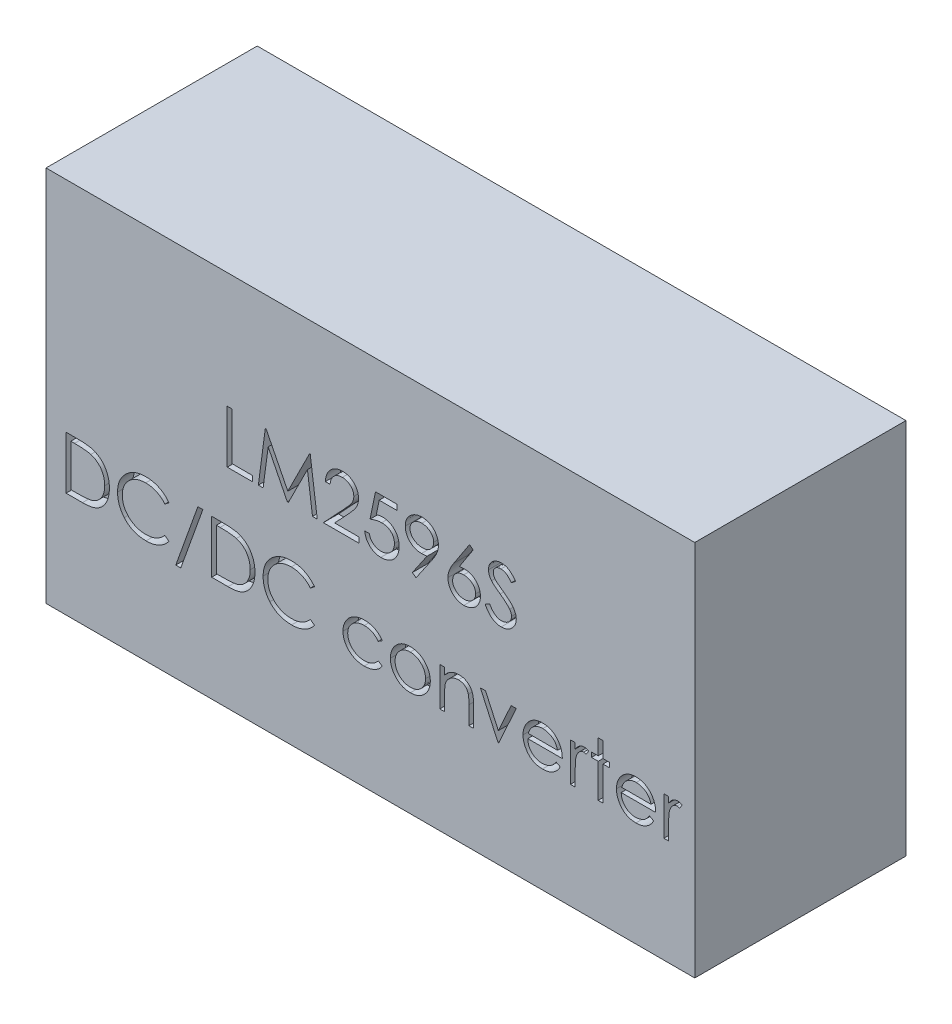
from build123d import *

# Parameters (mm, degrees)
SKETCH_2_W          = 43
SKETCH_2_H          = 25
EXTRUDE_1_DEPTH     = 14
CUT_EXTRUDE_1_DEPTH = 1


with BuildPart() as part:
    # 스케치2 → 보스-돌출1 (new body)
    with BuildSketch(Plane.XY):
        Rectangle(SKETCH_2_W, SKETCH_2_H)
    extrude(amount=EXTRUDE_1_DEPTH)

    # 스케치3 → 컷-돌출1 (cut)
    # profile 1 of 21: a face of its own
    with BuildSketch(Plane.XY.offset(14)):
        Polygon((-9.490384615, 4.829230769), (-9.176282051, 4.829230769), (-9.176282051, 1.688205128), (-7.830128205, 1.688205128), (-7.830128205, 1.329230769), (-9.490384615, 1.329230769), align=None)
    # profile 2 of 21: a face of its own
    with BuildSketch(Plane.XY.offset(14)):
        Polygon((-7.426282051, 1.329230769), (-6.964242788, 4.829230769), (-6.919370994, 4.829230769), (-5.474358974, 1.957435897), (-4.032852564, 4.829230769), (-3.987279647, 4.829230769), (-3.522435897, 1.329230769), (-3.837940705, 1.329230769), (-4.173076923, 3.847660256), (-5.436498397, 1.329230769), (-5.507311699, 1.329230769), (-6.775641026, 3.853269231), (-7.110076122, 1.329230769), align=None)
    # profile 3 of 21: a face of its own
    with BuildSketch(Plane.XY.offset(14)):
        with BuildLine():
            Line((-2.669871795, 3.752307692), (-2.983974359, 3.752307692))
            add(Edge.make_bspline(
                [(-2.983974359, 3.752307692), (-2.981927206, 3.79397858), (-2.977906652, 3.875819095), (-2.959078363, 3.995143001), (-2.932137485, 4.1091978), (-2.894046031, 4.217067714), (-2.846739754, 4.319706521), (-2.790009726, 4.416706537), (-2.722815876, 4.507697725), (-2.646609142, 4.591836569), (-2.563840503, 4.669024139), (-2.474534563, 4.735679382), (-2.380689536, 4.791997054), (-2.282590137, 4.839078295), (-2.179129573, 4.874418141), (-2.071246716, 4.900639781), (-1.958467579, 4.916416127), (-1.881627557, 4.918111912), (-1.842548077, 4.918974359)],
                knots=[0, 0, 0, 0, 1.10065271, 2.161652631, 3.183658789, 4.190468796, 5.17591951, 6.163126047, 7.15150782, 8.156236427, 9.156009102, 10.134482811, 11.092018607, 12.041330605, 13.001268258, 13.972401359, 14.968799086, 16, 16, 16, 16], degree=3))
            add(Edge.make_bspline(
                [(-1.842548077, 4.918974359), (-1.804170003, 4.918075903), (-1.728758458, 4.916310468), (-1.618696444, 4.901149438), (-1.513919149, 4.877403847), (-1.414631383, 4.84408843), (-1.321625318, 4.799304003), (-1.234202274, 4.745506464), (-1.151321463, 4.683286633), (-1.076714679, 4.61003282), (-1.0082066, 4.531830435), (-0.949104345, 4.448342532), (-0.898491181, 4.362113246), (-0.856303501, 4.272485044), (-0.825247363, 4.178614016), (-0.801669155, 4.081866813), (-0.788341741, 3.981242002), (-0.786296317, 3.913135446), (-0.78525641, 3.878509615)],
                knots=[0, 0, 0, 0, 1.111607364, 2.184268762, 3.212621178, 4.221274766, 5.211760367, 6.196651075, 7.1921475, 8.207485113, 9.220403448, 10.201281604, 11.166441695, 12.114753415, 13.065576456, 14.026450734, 14.996634279, 16, 16, 16, 16], degree=3))
            add(Edge.make_bspline(
                [(-0.78525641, 3.878509615), (-0.786949673, 3.829761781), (-0.790306484, 3.733121567), (-0.819020861, 3.591106704), (-0.863867372, 3.453513285), (-0.917864729, 3.342775983), (-0.972337173, 3.253542489), (-1.021424681, 3.180073785), (-1.078889492, 3.100968316), (-1.14556799, 3.016490979), (-1.220080862, 2.925980074), (-1.303103025, 2.829490278), (-1.395226507, 2.728018508), (-1.459885008, 2.658712907), (-1.493389423, 2.622800481)],
                knots=[0, 0, 0, 0, 1.184426356, 2.348067706, 3.509069118, 4.696110526, 5.333549288, 6.050745305, 6.844228056, 7.710549037, 8.667450064, 9.695053472, 10.805634456, 12, 12, 12, 12], degree=3))
            Line((-1.493389423, 2.622800481), (-2.369090545, 1.688205128))
            Line((-2.369090545, 1.688205128), (-0.740384615, 1.688205128))
            Line((-0.740384615, 1.688205128), (-0.740384615, 1.329230769))
            Line((-0.740384615, 1.329230769), (-3.118589744, 1.329230769))
            Line((-3.118589744, 1.329230769), (-1.761217949, 2.777748397))
            add(Edge.make_bspline(
                [(-1.761217949, 2.777748397), (-1.728170062, 2.812246704), (-1.664691835, 2.878510891), (-1.574909258, 2.975253851), (-1.49427027, 3.065003391), (-1.422252877, 3.14758994), (-1.360419372, 3.224221508), (-1.30554714, 3.292416211), (-1.261581549, 3.355170662), (-1.213866153, 3.427911276), (-1.167652172, 3.516723593), (-1.127939815, 3.625257282), (-1.103724967, 3.736984535), (-1.100820132, 3.812486572), (-1.099358974, 3.850464744)],
                knots=[0, 0, 0, 0, 1.329631726, 2.553950428, 3.673215718, 4.687767853, 5.603093632, 6.413772471, 7.123043292, 7.734684054, 8.834405432, 9.900288307, 10.943827018, 12, 12, 12, 12], degree=3))
            add(Edge.make_bspline(
                [(-1.099358974, 3.850464744), (-1.099994717, 3.874346142), (-1.101247643, 3.921411792), (-1.11230534, 3.990417551), (-1.129015846, 4.056982365), (-1.152961104, 4.121310984), (-1.184567844, 4.182756636), (-1.223041224, 4.241394117), (-1.267431288, 4.298083082), (-1.318782557, 4.35123638), (-1.375194077, 4.399917585), (-1.434788326, 4.443041671), (-1.497838431, 4.479080782), (-1.564078553, 4.508624279), (-1.633324022, 4.53179966), (-1.705708767, 4.547858239), (-1.781032784, 4.557940723), (-1.832466279, 4.559304895), (-1.858673878, 4.56)],
                knots=[0, 0, 0, 0, 0.991446411, 1.95395049, 2.89581595, 3.838931463, 4.798493298, 5.75982156, 6.748411868, 7.785213223, 8.824556874, 9.840280684, 10.836137867, 11.835679398, 12.848801643, 13.863922112, 14.911575587, 16, 16, 16, 16], degree=3))
            add(Edge.make_bspline(
                [(-1.858673878, 4.56), (-1.886044711, 4.559284968), (-1.939796507, 4.557880762), (-2.01871554, 4.548058098), (-2.094001318, 4.531112258), (-2.165843221, 4.507935584), (-2.234362806, 4.478477035), (-2.29922685, 4.44178529), (-2.36028974, 4.398001797), (-2.417666263, 4.348361241), (-2.470530242, 4.293093639), (-2.516977118, 4.231483676), (-2.557561132, 4.164656261), (-2.592970366, 4.09279171), (-2.621726056, 4.01523793), (-2.643699206, 3.932270226), (-2.661086053, 3.844248844), (-2.666894573, 3.783463759), (-2.669871795, 3.752307692)],
                knots=[0, 0, 0, 0, 1.031018746, 2.02475058, 2.990194455, 3.934040569, 4.864654155, 5.795059489, 6.735614925, 7.690564532, 8.649604399, 9.611025574, 10.590972636, 11.591080095, 12.624614302, 13.701020113, 14.821632451, 16, 16, 16, 16], degree=3))
        make_face()
    # profile 4 of 21: a face of its own
    with BuildSketch(Plane.XY.offset(14)):
        with BuildLine():
            Line((1.772435897, 4.829230769), (1.772435897, 4.47025641))
            Line((1.772435897, 4.47025641), (0.58193109, 4.47025641))
            Line((0.58193109, 4.47025641), (0.393329327, 3.549683494))
            add(Edge.make_bspline(
                [(0.393329327, 3.549683494), (0.430385201, 3.559913765), (0.502175097, 3.579733299), (0.608134958, 3.601739069), (0.708727162, 3.615004513), (0.774002532, 3.616815824), (0.805588942, 3.617692308)],
                knots=[0, 0, 0, 0, 1.100273476, 2.13160584, 3.095893838, 4, 4, 4, 4], degree=3))
            add(Edge.make_bspline(
                [(0.805588942, 3.617692308), (0.844672682, 3.616846372), (0.921521079, 3.615183051), (1.033960026, 3.599211202), (1.14129292, 3.574071287), (1.24329529, 3.538950765), (1.34015584, 3.494041032), (1.430983402, 3.437941092), (1.517141315, 3.372407761), (1.597083909, 3.297062749), (1.669608217, 3.214141132), (1.733374207, 3.124983261), (1.787536797, 3.030455599), (1.831097552, 2.92965499), (1.865881886, 2.823695837), (1.889033881, 2.711463254), (1.90445059, 2.594015134), (1.906172976, 2.513710564), (1.907051282, 2.472760417)],
                knots=[0, 0, 0, 0, 1.052922333, 2.070308379, 3.05430497, 4.020497103, 4.973039431, 5.925935799, 6.892292201, 7.88610001, 8.88166317, 9.857072816, 10.836096531, 11.812156883, 12.81219415, 13.836441305, 14.89672472, 16, 16, 16, 16], degree=3))
            add(Edge.make_bspline(
                [(1.907051282, 2.472760417), (1.906386207, 2.444238196), (1.905065044, 2.387579209), (1.898346457, 2.303435008), (1.88541074, 2.221072175), (1.868043016, 2.140479783), (1.845500598, 2.061810411), (1.818211544, 1.984838883), (1.784815517, 1.910044276), (1.748184142, 1.836718881), (1.706937664, 1.766520374), (1.661159156, 1.700871388), (1.612793665, 1.638787106), (1.56075228, 1.580933373), (1.504551285, 1.527690355), (1.444871318, 1.478742074), (1.382188599, 1.433260743), (1.315533356, 1.393092548), (1.246390873, 1.356129592), (1.173762656, 1.325806055), (1.099301956, 1.298695527), (1.02193708, 1.277085999), (0.941843268, 1.260153444), (0.858888492, 1.248652844), (0.773507822, 1.240276406), (0.715632809, 1.239752049), (0.686398237, 1.239487179)],
                knots=[0, 0, 0, 0, 1.056347294, 2.098418968, 3.122841568, 4.141288669, 5.149314143, 6.15115421, 7.162517403, 8.180376062, 9.185164535, 10.17417709, 11.141909838, 12.097768115, 13.052685741, 14.0056014, 14.954263652, 15.917497458, 16.885230207, 17.854509472, 18.828990115, 19.81800267, 20.826176721, 21.857883937, 22.917946725, 24, 24, 24, 24], degree=3))
            add(Edge.make_bspline(
                [(0.686398237, 1.239487179), (0.651524056, 1.240178017), (0.582913226, 1.24153716), (0.482392659, 1.255755645), (0.385678053, 1.276119561), (0.293547952, 1.306755831), (0.205176688, 1.345143126), (0.12175397, 1.393659297), (0.041148194, 1.448638401), (-0.033363842, 1.513518754), (-0.102519956, 1.584434436), (-0.164426465, 1.661392077), (-0.219560042, 1.743121519), (-0.267037789, 1.830019673), (-0.30753581, 1.921858204), (-0.339350798, 2.018981205), (-0.365029153, 2.120881209), (-0.375892574, 2.19103472), (-0.381410256, 2.226666667)],
                knots=[0, 0, 0, 0, 1.0467383, 2.05933395, 3.04377827, 4.011590433, 4.970194871, 5.932262533, 6.905835911, 7.896367577, 8.894135286, 9.877477877, 10.858688626, 11.851381753, 12.8477658, 13.868841284, 14.917554742, 16, 16, 16, 16], degree=3))
            Line((-0.381410256, 2.226666667), (-0.067307692, 2.226666667))
            add(Edge.make_bspline(
                [(-0.067307692, 2.226666667), (-0.059579135, 2.193290214), (-0.044724418, 2.129138819), (-0.01211867, 2.039007478), (0.027747206, 1.958688254), (0.075151554, 1.887118671), (0.131701585, 1.824709674), (0.196231014, 1.769092612), (0.268578737, 1.718917483), (0.348971966, 1.677094715), (0.433785046, 1.641425962), (0.522552256, 1.617674267), (0.612856602, 1.600973374), (0.673934972, 1.599301613), (0.704627404, 1.598461538)],
                knots=[0, 0, 0, 0, 1.136247022, 2.183929868, 3.172523383, 4.106158343, 5.02341133, 5.958108904, 6.928429099, 7.938127109, 8.96079061, 9.975095812, 10.982467395, 12, 12, 12, 12], degree=3))
            add(Edge.make_bspline(
                [(0.704627404, 1.598461538), (0.734585848, 1.599282316), (0.79357427, 1.600898435), (0.880385657, 1.613337447), (0.964198531, 1.632495018), (1.044185888, 1.661164873), (1.121747428, 1.696009592), (1.194921198, 1.740724667), (1.265824075, 1.792184686), (1.332252209, 1.851141316), (1.393091658, 1.916111011), (1.446847779, 1.985588404), (1.491624693, 2.05970525), (1.529358801, 2.137178403), (1.5580121, 2.218856961), (1.578453082, 2.304358136), (1.59045614, 2.393893116), (1.59210732, 2.454962426), (1.592948718, 2.486081731)],
                knots=[0, 0, 0, 0, 1.027316725, 2.022795036, 3.002884548, 3.971462791, 4.93288096, 5.914575861, 6.907176829, 7.935150275, 8.956128384, 9.956726525, 10.942570165, 11.921478529, 12.907843606, 13.90538589, 14.932640048, 16, 16, 16, 16], degree=3))
            add(Edge.make_bspline(
                [(1.592948718, 2.486081731), (1.592290238, 2.514157482), (1.591001359, 2.569111771), (1.580470788, 2.649510978), (1.562153816, 2.72558402), (1.536729936, 2.797698254), (1.504450428, 2.865921697), (1.465004116, 2.930324757), (1.417650718, 2.99005859), (1.363558829, 3.045151144), (1.304300789, 3.095996018), (1.238857046, 3.139340105), (1.168597119, 3.175804023), (1.09436752, 3.207272021), (1.014402621, 3.229872766), (0.930285989, 3.246840652), (0.841109281, 3.256656014), (0.780138593, 3.258017903), (0.748798077, 3.258717949)],
                knots=[0, 0, 0, 0, 1.045622112, 2.046656509, 3.013763289, 3.955457236, 4.890082067, 5.820317437, 6.762574623, 7.722996705, 8.69280354, 9.665887285, 10.63943826, 11.638615906, 12.663482002, 13.728887084, 14.832589034, 16, 16, 16, 16], degree=3))
            add(Edge.make_bspline(
                [(0.748798077, 3.258717949), (0.721669148, 3.258137358), (0.665654793, 3.256938584), (0.579731966, 3.248112087), (0.489440243, 3.233872793), (0.395125748, 3.214286545), (0.296505239, 3.188655469), (0.193786839, 3.157940968), (0.086754572, 3.121218969), (0.014636848, 3.093486756), (-0.022435897, 3.079230769)],
                knots=[0, 0, 0, 0, 0.817624296, 1.688186739, 2.600797293, 3.572016777, 4.590301741, 5.671205678, 6.80286297, 8, 8, 8, 8], degree=3))
            Line((-0.022435897, 3.079230769), (0.336538462, 4.829230769))
            Line((0.336538462, 4.829230769), (1.772435897, 4.829230769))
        make_face()
    # profile 5 of 21: a face of its own
    with BuildSketch(Plane.XY.offset(14)):
        with BuildLine():
            Line((3.028846154, 1.239487179), (2.777844551, 1.414066506))
            Line((2.777844551, 1.414066506), (3.751001603, 2.836642628))
            add(Edge.make_bspline(
                [(3.751001603, 2.836642628), (3.688910867, 2.829049565), (3.566650747, 2.8140984), (3.443513645, 2.811351745), (3.38291266, 2.81)],
                knots=[0, 0, 0, 0, 1.015715272, 2, 2, 2, 2], degree=3))
            add(Edge.make_bspline(
                [(3.38291266, 2.81), (3.346170612, 2.810941076), (3.274049186, 2.812788327), (3.168017533, 2.827430136), (3.066131973, 2.849980263), (2.968662617, 2.883629018), (2.875243112, 2.925447227), (2.786077398, 2.977304241), (2.701285508, 3.038310533), (2.621778098, 3.108143524), (2.549466359, 3.184821577), (2.485043061, 3.26597722), (2.431501929, 3.35255319), (2.387025344, 3.44278341), (2.35329489, 3.537964761), (2.328732353, 3.637014161), (2.313609998, 3.740625803), (2.311810903, 3.811150934), (2.310897436, 3.846959135)],
                knots=[0, 0, 0, 0, 1.060718605, 2.082097864, 3.085795603, 4.069760067, 5.054557537, 6.03741023, 7.043284206, 8.066802108, 9.088538119, 10.083643548, 11.053783639, 12.022749082, 12.983451788, 13.964007469, 14.966251758, 16, 16, 16, 16], degree=3))
            add(Edge.make_bspline(
                [(2.310897436, 3.846959135), (2.312631871, 3.895927787), (2.316036214, 3.992043319), (2.343434732, 4.132477088), (2.388495071, 4.265263632), (2.451323448, 4.390053825), (2.530458169, 4.505052565), (2.625566759, 4.608661174), (2.736070723, 4.699406028), (2.859452743, 4.777410105), (2.992805763, 4.840145102), (3.132474421, 4.886384403), (3.277388541, 4.913583151), (3.375556212, 4.917169012), (3.424979968, 4.918974359)],
                knots=[0, 0, 0, 0, 1.022988612, 2.007919123, 2.978103895, 3.94594894, 4.918897164, 5.887013414, 6.875921846, 7.89917871, 8.930658928, 9.948724884, 10.967259574, 12, 12, 12, 12], degree=3))
            add(Edge.make_bspline(
                [(3.424979968, 4.918974359), (3.473468388, 4.917144196), (3.569276934, 4.913527966), (3.710165941, 4.887043997), (3.845106958, 4.842407324), (3.973351945, 4.780722761), (4.092091357, 4.703401853), (4.198867168, 4.611267329), (4.291242707, 4.504261802), (4.369066588, 4.384973312), (4.431536628, 4.256806331), (4.476608911, 4.123022408), (4.50435455, 3.984583687), (4.507850877, 3.890789213), (4.509615385, 3.843453526)],
                knots=[0, 0, 0, 0, 1.026385292, 2.028040595, 3.023318987, 4.028184125, 5.03290303, 6.015178782, 7.004435299, 8.016004309, 9.023023918, 10.015172535, 10.998308025, 12, 12, 12, 12], degree=3))
            add(Edge.make_bspline(
                [(4.509615385, 3.843453526), (4.508436976, 3.806709758), (4.506046868, 3.732184218), (4.489310561, 3.618953875), (4.460890376, 3.503502646), (4.428638677, 3.40578105), (4.397506509, 3.3250726), (4.368205378, 3.26132102), (4.335693224, 3.194219757), (4.297774459, 3.124472419), (4.257012162, 3.051189884), (4.210952885, 2.975107168), (4.160647313, 2.896122175), (4.124817594, 2.842875087), (4.106470353, 2.815608974)],
                knots=[0, 0, 0, 0, 1.179839688, 2.393009684, 3.667231171, 4.993948276, 5.694988576, 6.444077775, 7.246288328, 8.089075292, 8.993003841, 9.939041771, 10.944649915, 12, 12, 12, 12], degree=3))
            Line((4.106470353, 2.815608974), (3.028846154, 1.239487179))
        make_face()
        with BuildLine():
            add(Edge.make_bspline(
                [(3.441105769, 3.168974359), (3.468939783, 3.169734743), (3.523123146, 3.171214951), (3.602500445, 3.180224193), (3.677424649, 3.196198179), (3.748095898, 3.219117891), (3.8152228, 3.24677456), (3.877739128, 3.281986546), (3.935697204, 3.324003181), (3.989485131, 3.371213197), (4.03724913, 3.423663781), (4.079792161, 3.478560887), (4.115952728, 3.536145497), (4.144516005, 3.59713876), (4.168000581, 3.660055968), (4.184218593, 3.725910323), (4.193202926, 3.794358724), (4.194734501, 3.840857382), (4.195512821, 3.864487179)],
                knots=[0, 0, 0, 0, 1.163407946, 2.26475976, 3.333800367, 4.359385343, 5.366239384, 6.363380779, 7.350133999, 8.353570782, 9.349036268, 10.310270964, 11.253520213, 12.184142, 13.120487599, 14.056272588, 15.012232024, 16, 16, 16, 16], degree=3))
            add(Edge.make_bspline(
                [(4.195512821, 3.864487179), (4.194843151, 3.888126845), (4.193523486, 3.934711705), (4.182936186, 4.003261445), (4.164310963, 4.068954705), (4.139320479, 4.132151135), (4.106400241, 4.192331507), (4.066896755, 4.250251379), (4.019964305, 4.305543507), (3.965961739, 4.35690749), (3.907727186, 4.40425539), (3.845666686, 4.446041466), (3.78029177, 4.481062662), (3.71200128, 4.509961632), (3.640652931, 4.532513407), (3.566288943, 4.548730772), (3.488533537, 4.557702527), (3.435752251, 4.559224421), (3.408854167, 4.56)],
                knots=[0, 0, 0, 0, 0.972161553, 1.915763587, 2.844109794, 3.775983486, 4.705125789, 5.659731448, 6.655561913, 7.682237399, 8.721216875, 9.739758359, 10.754845918, 11.767244016, 12.7857855, 13.828538656, 14.893392813, 16, 16, 16, 16], degree=3))
            add(Edge.make_bspline(
                [(3.408854167, 4.56), (3.382190013, 4.559223168), (3.329875164, 4.557699031), (3.252811005, 4.548747826), (3.178949837, 4.532404342), (3.107808216, 4.509972078), (3.039519756, 4.481060506), (2.974147923, 4.446039631), (2.912072906, 4.404265008), (2.853894186, 4.356870236), (2.799796264, 4.30578259), (2.753670735, 4.250009161), (2.714076842, 4.192361636), (2.68120184, 4.132143128), (2.656199322, 4.068956842), (2.637577321, 4.003260866), (2.626989155, 3.934711856), (2.625669609, 3.888126895), (2.625, 3.864487179)],
                knots=[0, 0, 0, 0, 1.099389452, 2.15699305, 3.192601482, 4.213358962, 5.227959689, 6.245255729, 7.266013209, 8.307253147, 9.336162325, 10.327954924, 11.284637477, 12.215801273, 13.149702402, 14.080068371, 15.025723358, 16, 16, 16, 16], degree=3))
            add(Edge.make_bspline(
                [(2.625, 3.864487179), (2.625605926, 3.840838981), (2.626800923, 3.794200405), (2.638328713, 3.725674012), (2.657606993, 3.659985818), (2.683426383, 3.596497111), (2.717427974, 3.535825253), (2.759151822, 3.478257891), (2.808057368, 3.42314244), (2.863490855, 3.371335229), (2.924159016, 3.323783053), (2.988955762, 3.282252671), (3.056765599, 3.247180227), (3.12782723, 3.219038843), (3.20161403, 3.196427179), (3.278789161, 3.180253634), (3.359097399, 3.171301367), (3.413507381, 3.16975747), (3.441105769, 3.168974359)],
                knots=[0, 0, 0, 0, 0.952633368, 1.87876736, 2.791047057, 3.707742249, 4.635551637, 5.587206343, 6.568248508, 7.601284464, 8.641511608, 9.671105535, 10.699146789, 11.713763218, 12.747829548, 13.806491675, 14.887386225, 16, 16, 16, 16], degree=3))
        make_face(mode=Mode.SUBTRACT)
    # profile 6 of 21: a face of its own
    with BuildSketch(Plane.XY.offset(14)):
        with BuildLine():
            Line((6.573717949, 4.918974359), (6.815604968, 4.728970353))
            Line((6.815604968, 4.728970353), (5.890825321, 3.314807692))
            add(Edge.make_bspline(
                [(5.890825321, 3.314807692), (5.952395597, 3.324621553), (6.072495384, 3.343764598), (6.194061283, 3.346922543), (6.253305288, 3.348461538)],
                knots=[0, 0, 0, 0, 1.025318673, 2, 2, 2, 2], degree=3))
            add(Edge.make_bspline(
                [(6.253305288, 3.348461538), (6.288877785, 3.347505427), (6.358901185, 3.345623349), (6.461707987, 3.331139499), (6.560496923, 3.308314387), (6.654858536, 3.275042131), (6.745131518, 3.232539776), (6.831833914, 3.181600906), (6.913335924, 3.119595226), (6.990687103, 3.05033027), (7.0609142, 2.973613286), (7.123090256, 2.892211949), (7.175317048, 2.806211068), (7.217690969, 2.715654202), (7.250595848, 2.620680942), (7.274583493, 2.521412803), (7.288763086, 2.417781331), (7.290688576, 2.347303156), (7.291666667, 2.311502404)],
                knots=[0, 0, 0, 0, 1.04369286, 2.054478336, 3.041073146, 4.015093852, 4.984733326, 5.965804835, 6.960378782, 7.985147595, 9.009457201, 10.008161701, 10.986880575, 11.956520048, 12.937015923, 13.931873656, 14.949455224, 16, 16, 16, 16], degree=3))
            add(Edge.make_bspline(
                [(7.291666667, 2.311502404), (7.290243562, 2.2625227), (7.287443228, 2.166142234), (7.259539432, 2.025765528), (7.216179787, 1.892033012), (7.154202259, 1.767079841), (7.077219876, 1.651077271), (6.983342283, 1.548291806), (6.875898795, 1.456621768), (6.754411997, 1.379965149), (6.623669033, 1.317362098), (6.486317035, 1.272396856), (6.343689889, 1.244713387), (6.246885281, 1.241242784), (6.197916667, 1.239487179)],
                knots=[0, 0, 0, 0, 1.031375318, 2.029502543, 3.004789286, 3.987476834, 4.960371455, 5.9300674, 6.912260825, 7.929083631, 8.949397511, 9.960523116, 10.96833055, 12, 12, 12, 12], degree=3))
            add(Edge.make_bspline(
                [(6.197916667, 1.239487179), (6.150819966, 1.241015385), (6.057529648, 1.244042493), (5.920296854, 1.271008431), (5.788433836, 1.314715534), (5.662864456, 1.374929812), (5.546543843, 1.450987695), (5.442478206, 1.542549975), (5.351186432, 1.64765944), (5.275211811, 1.766299787), (5.214953079, 1.893789744), (5.169763154, 2.026726901), (5.14336691, 2.164626882), (5.139678354, 2.258108022), (5.137820513, 2.305192308)],
                knots=[0, 0, 0, 0, 1.012016664, 2.004627821, 2.994792927, 3.992885782, 4.990978636, 5.973936114, 6.964471063, 7.975201453, 8.993600317, 9.990122807, 10.98767138, 12, 12, 12, 12], degree=3))
            add(Edge.make_bspline(
                [(5.137820513, 2.305192308), (5.139001958, 2.341236891), (5.141414243, 2.414833043), (5.158257633, 2.526297071), (5.185322428, 2.640348153), (5.215632674, 2.737102346), (5.247658284, 2.816363868), (5.274310824, 2.880267359), (5.30748482, 2.946028432), (5.342858201, 3.015902068), (5.38361507, 3.088087501), (5.427930719, 3.16379117), (5.47703037, 3.241809098), (5.511450533, 3.294753293), (5.529046474, 3.32181891)],
                knots=[0, 0, 0, 0, 1.173818275, 2.396712641, 3.66331629, 4.989737886, 5.693666774, 6.447286557, 7.243889047, 8.091586357, 8.998013824, 9.943181721, 10.948533338, 12, 12, 12, 12], degree=3))
            Line((5.529046474, 3.32181891), (6.573717949, 4.918974359))
        make_face()
        with BuildLine():
            add(Edge.make_bspline(
                [(6.18739984, 2.989487179), (6.160737595, 2.988709136), (6.108658486, 2.98718939), (6.032251071, 2.978364139), (5.959937819, 2.961745073), (5.890760686, 2.940578741), (5.826012983, 2.911475681), (5.765224143, 2.876123882), (5.708159091, 2.834502704), (5.655415539, 2.787201793), (5.607595876, 2.73541376), (5.566414745, 2.679944238), (5.530892345, 2.622130035), (5.502010526, 2.561488093), (5.47952045, 2.498041593), (5.4632522, 2.432082344), (5.454198448, 2.363168038), (5.452692217, 2.316435535), (5.451923077, 2.292572115)],
                knots=[0, 0, 0, 0, 1.129588631, 2.206414736, 3.251139165, 4.268635594, 5.265702196, 6.250456724, 7.242448911, 8.251968645, 9.246821453, 10.222880186, 11.173611482, 12.116736599, 13.062300278, 14.020270554, 14.989073742, 16, 16, 16, 16], degree=3))
            add(Edge.make_bspline(
                [(5.451923077, 2.292572115), (5.452549438, 2.268922136), (5.45377764, 2.222548046), (5.46492996, 2.154208866), (5.481965042, 2.088443958), (5.507305438, 2.025592359), (5.537532326, 1.964696041), (5.57743765, 1.907960755), (5.621654436, 1.851940685), (5.67450837, 1.800939214), (5.731231733, 1.75348259), (5.791832935, 1.712002336), (5.854992895, 1.676516163), (5.921564317, 1.648705065), (5.990602701, 1.625880778), (6.062683255, 1.609819299), (6.137856111, 1.600738773), (6.188778049, 1.59923058), (6.21474359, 1.598461538)],
                knots=[0, 0, 0, 0, 0.989467248, 1.94019797, 2.891935182, 3.827694429, 4.772920941, 5.730924762, 6.725747692, 7.756678648, 8.79901574, 9.819492441, 10.826891316, 11.826466727, 12.835195252, 13.867842842, 14.912794438, 16, 16, 16, 16], degree=3))
            add(Edge.make_bspline(
                [(6.21474359, 1.598461538), (6.240709088, 1.59923064), (6.291630943, 1.600738952), (6.366804403, 1.609818621), (6.438882722, 1.625883268), (6.50792923, 1.648696039), (6.574470661, 1.676549648), (6.637575383, 1.711781568), (6.697603476, 1.753737686), (6.754364076, 1.800858114), (6.806998014, 1.852230966), (6.852275293, 1.907460688), (6.890958526, 1.965154584), (6.922392714, 2.025352474), (6.947454005, 2.088481961), (6.964575472, 2.154198685), (6.975704761, 2.222550711), (6.976936127, 2.268923036), (6.977564103, 2.292572115)],
                knots=[0, 0, 0, 0, 1.087397944, 2.132534446, 3.165364764, 4.174271784, 5.174024072, 6.181601208, 7.194203697, 8.236725232, 9.267838612, 10.269026844, 11.221737037, 12.171628256, 13.107553087, 14.05945871, 15.010357665, 16, 16, 16, 16], degree=3))
            add(Edge.make_bspline(
                [(6.977564103, 2.292572115), (6.97701381, 2.316466666), (6.975933763, 2.363363899), (6.963717815, 2.432051517), (6.946775441, 2.498376723), (6.92119241, 2.561922672), (6.887955865, 2.6224386), (6.847472458, 2.6802302), (6.800639888, 2.735740548), (6.746542349, 2.787303356), (6.687652115, 2.834450434), (6.625036529, 2.87606999), (6.559528556, 2.911194967), (6.491194613, 2.940502069), (6.41925173, 2.961651544), (6.344861391, 2.978304787), (6.267072149, 2.987166804), (6.21429554, 2.98870387), (6.18739984, 2.989487179)],
                knots=[0, 0, 0, 0, 0.978206639, 1.919901502, 2.851605144, 3.780102724, 4.718870031, 5.675451981, 6.667674623, 7.690630536, 8.733308323, 9.756129687, 10.767539656, 11.776269907, 12.797430371, 13.836405707, 14.897401972, 16, 16, 16, 16], degree=3))
        make_face(mode=Mode.SUBTRACT)
    # profile 7 of 21: a face of its own
    with BuildSketch(Plane.XY.offset(14)):
        with BuildLine():
            Line((7.605769231, 2.004411058), (7.901642628, 2.181794872))
            add(Edge.make_bspline(
                [(7.901642628, 2.181794872), (7.929160865, 2.135730487), (7.981884746, 2.047472903), (8.069836105, 1.928214863), (8.160969016, 1.826852706), (8.25595835, 1.743976098), (8.354224298, 1.678727211), (8.456408352, 1.63252498), (8.562166163, 1.603709004), (8.634139984, 1.600208918), (8.670072115, 1.598461538)],
                knots=[0, 0, 0, 0, 1.272034388, 2.437168799, 3.508375237, 4.49857839, 5.41946034, 6.295179144, 7.148887113, 8, 8, 8, 8], degree=3))
            add(Edge.make_bspline(
                [(8.670072115, 1.598461538), (8.700758976, 1.599316211), (8.761595749, 1.601010601), (8.851157992, 1.617291403), (8.938139794, 1.642303532), (9.020748432, 1.678124464), (9.097844046, 1.721462949), (9.165450742, 1.773809127), (9.223896855, 1.832415333), (9.27170597, 1.897797987), (9.308386005, 1.968115136), (9.336578073, 2.040291087), (9.352223147, 2.115459656), (9.3545799, 2.166070118), (9.355769231, 2.191610577)],
                knots=[0, 0, 0, 0, 1.095163259, 2.171163733, 3.241058638, 4.321873601, 5.38011039, 6.391990106, 7.366004449, 8.327778327, 9.272591725, 10.192022065, 11.087607919, 12, 12, 12, 12], degree=3))
            add(Edge.make_bspline(
                [(9.355769231, 2.191610577), (9.35429492, 2.220751427), (9.351297862, 2.279990516), (9.325966382, 2.367390169), (9.286117135, 2.453882739), (9.249354491, 2.507384004), (9.230268429, 2.535160256)],
                knots=[0, 0, 0, 0, 0.938893495, 1.908633276, 2.914225137, 4, 4, 4, 4], degree=3))
            add(Edge.make_bspline(
                [(9.230268429, 2.535160256), (9.214597815, 2.55520708), (9.181699321, 2.597292879), (9.125141808, 2.659938114), (9.058775694, 2.724556533), (8.984872139, 2.79361559), (8.90073905, 2.863903387), (8.809011536, 2.938771665), (8.707347677, 3.015373242), (8.63604818, 3.066745807), (8.599258814, 3.093253205)],
                knots=[0, 0, 0, 0, 0.722233717, 1.516239348, 2.393582979, 3.351407094, 4.387010283, 5.505090956, 6.712668013, 8, 8, 8, 8], degree=3))
            add(Edge.make_bspline(
                [(8.599258814, 3.093253205), (8.562434818, 3.119481793), (8.492030141, 3.169628855), (8.393571559, 3.244053139), (8.305527096, 3.312097009), (8.228288079, 3.374401021), (8.161888483, 3.430973625), (8.105805072, 3.481271565), (8.061466515, 3.526655125), (8.036810934, 3.556096467), (8.025741186, 3.569314904)],
                knots=[0, 0, 0, 0, 1.452282411, 2.77665338, 3.964542531, 5.026858415, 5.96415736, 6.766646006, 7.446254459, 8, 8, 8, 8], degree=3))
            add(Edge.make_bspline(
                [(8.025741186, 3.569314904), (8.010268641, 3.589915941), (7.979839804, 3.630430644), (7.939673798, 3.693755502), (7.905534636, 3.758578768), (7.878772304, 3.825074632), (7.856236085, 3.892309561), (7.841078154, 3.961160807), (7.831586757, 4.031319425), (7.830614771, 4.078532926), (7.830128205, 4.102167468)],
                knots=[0, 0, 0, 0, 1.068054152, 2.10047183, 3.106115577, 4.101338837, 5.06977816, 6.043150881, 7.020423561, 8, 8, 8, 8], degree=3))
            add(Edge.make_bspline(
                [(7.830128205, 4.102167468), (7.831433414, 4.139197243), (7.834015934, 4.212465306), (7.855856451, 4.319496137), (7.890329345, 4.421682554), (7.938624233, 4.518012888), (8.000881586, 4.605978869), (8.07292756, 4.686592356), (8.158739046, 4.754360938), (8.25289167, 4.813572996), (8.355948042, 4.859918921), (8.463938945, 4.894879901), (8.577036017, 4.914689159), (8.653639152, 4.917531924), (8.692508013, 4.918974359)],
                knots=[0, 0, 0, 0, 1.005424448, 1.989358655, 2.955360095, 3.929531133, 4.905563448, 5.876582895, 6.856512386, 7.866279853, 8.892233794, 9.918561126, 10.94386622, 12, 12, 12, 12], degree=3))
            add(Edge.make_bspline(
                [(8.692508013, 4.918974359), (8.733752113, 4.917551807), (8.815773465, 4.914722806), (8.93642268, 4.890125275), (9.052583397, 4.849424603), (9.146026662, 4.803235945), (9.219159423, 4.757104529), (9.274932156, 4.715084705), (9.331449607, 4.666709597), (9.389167661, 4.611850351), (9.447108321, 4.550003599), (9.506131773, 4.481592911), (9.566376042, 4.407036355), (9.605131902, 4.353811854), (9.625, 4.326526442)],
                knots=[0, 0, 0, 0, 1.286793592, 2.559021753, 3.825965368, 5.121522368, 5.803751409, 6.523245864, 7.299691795, 8.125521123, 9.008227632, 9.944561021, 10.946284179, 12, 12, 12, 12], degree=3))
            Line((9.625, 4.326526442), (9.341045673, 4.111282051))
            add(Edge.make_bspline(
                [(9.341045673, 4.111282051), (9.323899741, 4.133370742), (9.290880684, 4.175908395), (9.240751197, 4.235479711), (9.193502549, 4.28989619), (9.146952149, 4.337161318), (9.103558518, 4.379863451), (9.061441475, 4.416423208), (9.021207124, 4.447198804), (8.970490213, 4.480042364), (8.906772495, 4.512598867), (8.826787959, 4.540147945), (8.743201684, 4.556703007), (8.686272052, 4.558891895), (8.657451923, 4.56)],
                knots=[0, 0, 0, 0, 1.181633172, 2.275549214, 3.290209073, 4.226197932, 5.078386478, 5.862611352, 6.581680152, 7.217281963, 8.414376989, 9.595101626, 10.782541182, 12, 12, 12, 12], degree=3))
            add(Edge.make_bspline(
                [(8.657451923, 4.56), (8.621295401, 4.5587883), (8.551570953, 4.556451651), (8.452580717, 4.530931666), (8.363486792, 4.490749805), (8.286934227, 4.434434827), (8.22319725, 4.367713834), (8.177091791, 4.290934979), (8.149341627, 4.206152577), (8.145955347, 4.14701092), (8.144230769, 4.116891026)],
                knots=[0, 0, 0, 0, 1.14458467, 2.207223713, 3.21896685, 4.227309161, 5.202851033, 6.127160689, 7.046193047, 8, 8, 8, 8], degree=3))
            add(Edge.make_bspline(
                [(8.144230769, 4.116891026), (8.144623896, 4.098139547), (8.145410792, 4.060605928), (8.15638559, 4.005154506), (8.170484919, 3.949843166), (8.19282755, 3.894920583), (8.223672854, 3.839426224), (8.26417803, 3.782404487), (8.315191342, 3.723352778), (8.354268354, 3.684945404), (8.37489984, 3.664667468)],
                knots=[0, 0, 0, 0, 0.858281714, 1.717966888, 2.583508476, 3.4729293, 4.427298488, 5.488583878, 6.674047936, 8, 8, 8, 8], degree=3))
            add(Edge.make_bspline(
                [(8.37489984, 3.664667468), (8.382561212, 3.657830442), (8.400762879, 3.641587234), (8.434038805, 3.614994953), (8.477981603, 3.582192181), (8.531443804, 3.541604864), (8.595411166, 3.494523402), (8.669890722, 3.44154979), (8.754052255, 3.380964331), (8.813774171, 3.33860679), (8.845352564, 3.316209936)],
                knots=[0, 0, 0, 0, 0.420754252, 0.999615792, 1.744751191, 2.668019286, 3.750313428, 4.999500688, 6.413464383, 8, 8, 8, 8], degree=3))
            add(Edge.make_bspline(
                [(8.845352564, 3.316209936), (8.883338477, 3.288568576), (8.956892934, 3.235044915), (9.061550514, 3.154629235), (9.156444322, 3.075981466), (9.241907525, 2.999603859), (9.318784434, 2.926075766), (9.386222154, 2.854512586), (9.444907835, 2.785427013), (9.508087053, 2.696854437), (9.572644873, 2.588073353), (9.62808638, 2.454795114), (9.663044728, 2.320998794), (9.667616243, 2.231071957), (9.669871795, 2.186702724)],
                knots=[0, 0, 0, 0, 1.163667725, 2.253281268, 3.268753668, 4.215851969, 5.092017293, 5.902905408, 6.650798638, 7.335211899, 8.59617414, 9.77448103, 10.901945474, 12, 12, 12, 12], degree=3))
            add(Edge.make_bspline(
                [(9.669871795, 2.186702724), (9.669214657, 2.155324359), (9.667913142, 2.093176976), (9.652952228, 2.001921899), (9.631032563, 1.913291029), (9.597995329, 1.828379917), (9.557672171, 1.745635154), (9.506505923, 1.667227254), (9.447198238, 1.591420855), (9.379164473, 1.520237364), (9.304718571, 1.454891168), (9.226034876, 1.396762106), (9.142984603, 1.348293783), (9.056018286, 1.308742941), (8.96511595, 1.277809423), (8.870308166, 1.255396554), (8.771438655, 1.241640843), (8.704238173, 1.240213082), (8.670072115, 1.239487179)],
                knots=[0, 0, 0, 0, 0.983748083, 1.948392443, 2.894712957, 3.844097841, 4.80183111, 5.778335162, 6.776009319, 7.81870978, 8.863265674, 9.881300176, 10.883814829, 11.87499822, 12.874611388, 13.892143829, 14.928324115, 16, 16, 16, 16], degree=3))
            add(Edge.make_bspline(
                [(8.670072115, 1.239487179), (8.643636772, 1.239998361), (8.591099012, 1.241014286), (8.51338953, 1.249995567), (8.437249941, 1.26270267), (8.363635659, 1.28287674), (8.291598248, 1.307353718), (8.221451013, 1.33749205), (8.153159959, 1.373609252), (8.086342376, 1.414904276), (8.021168202, 1.462962021), (7.958248734, 1.518935517), (7.895519548, 1.581281022), (7.834832152, 1.651691586), (7.774959008, 1.729029668), (7.717080598, 1.814018852), (7.65999888, 1.906196206), (7.624183413, 1.971061291), (7.605769231, 2.004411058)],
                knots=[0, 0, 0, 0, 0.915332311, 1.819136955, 2.706846663, 3.586547465, 4.459518054, 5.340707479, 6.227863349, 7.133153174, 8.059268498, 9.028702269, 10.047606654, 11.120612155, 12.245963614, 13.433783089, 14.680604001, 16, 16, 16, 16], degree=3))
        make_face()
    # profile 8 of 21: a face of its own
    with BuildSketch(Plane.XY.offset(14)):
        with BuildLine():
            Line((-20.169871795, -5.504102564), (-20.169871795, -2.004102564))
            Line((-20.169871795, -2.004102564), (-19.463141026, -2.004102564))
            add(Edge.make_bspline(
                [(-19.463141026, -2.004102564), (-19.401672037, -2.004545134), (-19.282914272, -2.005400177), (-19.111301825, -2.010821568), (-18.952518062, -2.020412034), (-18.807085203, -2.03438156), (-18.674603991, -2.051534594), (-18.555445383, -2.073034998), (-18.44899324, -2.098423169), (-18.3835238, -2.120068619), (-18.352564103, -2.130304487)],
                knots=[0, 0, 0, 0, 1.314313732, 2.53924729, 3.670748893, 4.714932338, 5.66265055, 6.526160246, 7.303039223, 8, 8, 8, 8], degree=3))
            add(Edge.make_bspline(
                [(-18.352564103, -2.130304487), (-18.312069363, -2.145735193), (-18.231998171, -2.176246687), (-18.117991048, -2.233802988), (-18.010665685, -2.29901609), (-17.909446541, -2.371971953), (-17.816645714, -2.454736301), (-17.728637817, -2.543793387), (-17.649023094, -2.642381727), (-17.576114798, -2.748456715), (-17.510379138, -2.860768767), (-17.45323998, -2.979103876), (-17.405785987, -3.102861084), (-17.36639276, -3.231696232), (-17.335346303, -3.36589261), (-17.314164371, -3.505606476), (-17.300193381, -3.650285665), (-17.29878933, -3.748460129), (-17.298076923, -3.798273237)],
                knots=[0, 0, 0, 0, 0.984719456, 1.947108742, 2.898477687, 3.838006223, 4.779231079, 5.722358779, 6.681677486, 7.655904652, 8.64651281, 9.637519902, 10.640069247, 11.656948941, 12.698408672, 13.768548281, 14.867775369, 16, 16, 16, 16], degree=3))
            add(Edge.make_bspline(
                [(-17.298076923, -3.798273237), (-17.298705891, -3.841534476), (-17.299945337, -3.926785265), (-17.311074653, -4.05242616), (-17.327250973, -4.174339732), (-17.35229517, -4.291945432), (-17.382697684, -4.406273649), (-17.421661835, -4.516105894), (-17.466297331, -4.622449703), (-17.51834721, -4.723867179), (-17.575488595, -4.819950551), (-17.636810338, -4.91052608), (-17.702247033, -4.994301301), (-17.772422666, -5.071529913), (-17.846430383, -5.142095492), (-17.924754713, -5.206587507), (-18.007597764, -5.263744062), (-18.094588487, -5.31581117), (-18.188264616, -5.361231526), (-18.290400482, -5.399661536), (-18.40143166, -5.431508151), (-18.521085617, -5.458079047), (-18.649569095, -5.479156349), (-18.787008061, -5.493282742), (-18.93319135, -5.502835674), (-19.033570616, -5.503672068), (-19.085236378, -5.504102564)],
                knots=[0, 0, 0, 0, 1.105936401, 2.179363191, 3.223086493, 4.248585256, 5.251745608, 6.245858792, 7.225916811, 8.198733463, 9.158002045, 10.082870192, 10.993790845, 11.873723703, 12.748670949, 13.606408763, 14.465103618, 15.319838547, 16.196477973, 17.123216899, 18.106603292, 19.147568657, 20.255746949, 21.433717677, 22.679120308, 24, 24, 24, 24], degree=3))
            Line((-19.085236378, -5.504102564), (-20.169871795, -5.504102564))
        make_face()
        with BuildLine():
            Line((-19.855769231, -5.145128205), (-19.454026442, -5.145128205))
            add(Edge.make_bspline(
                [(-19.454026442, -5.145128205), (-19.396298072, -5.144880109), (-19.285265273, -5.144402929), (-19.125607276, -5.140215725), (-18.979727879, -5.133373788), (-18.84760637, -5.12379871), (-18.729317346, -5.111130095), (-18.624613596, -5.097005192), (-18.533838337, -5.079407741), (-18.478908901, -5.063456782), (-18.453525641, -5.056085737)],
                knots=[0, 0, 0, 0, 1.375205317, 2.645023457, 3.804390687, 4.853969522, 5.800190428, 6.637939096, 7.370582563, 8, 8, 8, 8], degree=3))
            add(Edge.make_bspline(
                [(-18.453525641, -5.056085737), (-18.421577279, -5.044834179), (-18.358443641, -5.022599806), (-18.267562556, -4.982042145), (-18.182805551, -4.934000075), (-18.102695526, -4.880597801), (-18.02836887, -4.819951799), (-17.958944754, -4.75338081), (-17.894562953, -4.680546035), (-17.835888645, -4.601537873), (-17.78338034, -4.516848078), (-17.737909111, -4.427309244), (-17.698057579, -4.333902434), (-17.666778987, -4.235193275), (-17.642263403, -4.132064217), (-17.624898715, -4.024508003), (-17.61408399, -3.912544722), (-17.612822542, -3.836392597), (-17.612179487, -3.797572115)],
                knots=[0, 0, 0, 0, 0.998632004, 1.973411704, 2.929992603, 3.868527914, 4.809262121, 5.754881198, 6.702106254, 7.672490631, 8.653608572, 9.636854334, 10.631411391, 11.644891563, 12.686317036, 13.754757253, 14.855430412, 16, 16, 16, 16], degree=3))
            add(Edge.make_bspline(
                [(-17.612179487, -3.797572115), (-17.612692775, -3.756638635), (-17.613701132, -3.676224451), (-17.626375443, -3.558233755), (-17.644896998, -3.444753105), (-17.671680684, -3.33577491), (-17.705811563, -3.231086557), (-17.748406205, -3.131267047), (-17.797072824, -3.035262178), (-17.854976161, -2.945287813), (-17.918391754, -2.860194703), (-17.988769633, -2.782239788), (-18.064991672, -2.711245488), (-18.146226521, -2.646106175), (-18.234763621, -2.589442499), (-18.328517312, -2.538755818), (-18.428862983, -2.495739927), (-18.498675679, -2.472861064), (-18.534154647, -2.461233974)],
                knots=[0, 0, 0, 0, 1.122418816, 2.205001699, 3.251619955, 4.274784885, 5.280384055, 6.268708349, 7.249350384, 8.229342522, 9.199999885, 10.157847722, 11.105861043, 12.055065948, 13.010012805, 13.98527497, 14.976112212, 16, 16, 16, 16], degree=3))
            add(Edge.make_bspline(
                [(-18.534154647, -2.461233974), (-18.563505794, -2.453117546), (-18.625914384, -2.435859794), (-18.727753848, -2.417034421), (-18.842368998, -2.400429922), (-18.970268699, -2.386371883), (-19.111307158, -2.376284562), (-19.265592846, -2.368713247), (-19.43319245, -2.363606615), (-19.549374984, -2.363257907), (-19.609675481, -2.363076923)],
                knots=[0, 0, 0, 0, 0.674548936, 1.434276114, 2.292660221, 3.240891867, 4.284742987, 5.42552168, 6.663806718, 8, 8, 8, 8], degree=3))
            Line((-19.609675481, -2.363076923), (-19.855769231, -2.363076923))
            Line((-19.855769231, -2.363076923), (-19.855769231, -5.145128205))
        make_face(mode=Mode.SUBTRACT)
    # profile 9 of 21: a face of its own
    with BuildSketch(Plane.XY.offset(14)):
        with BuildLine():
            Line((-13.349358974, -2.646330128), (-13.624198718, -2.856666667))
            add(Edge.make_bspline(
                [(-13.624198718, -2.856666667), (-13.643804606, -2.833300697), (-13.682752053, -2.786883781), (-13.745411256, -2.721704237), (-13.810712899, -2.660638975), (-13.87863202, -2.603397096), (-13.950391139, -2.55198033), (-14.024251938, -2.503709227), (-14.101449983, -2.460441489), (-14.208201718, -2.407978503), (-14.347849566, -2.353232348), (-14.523644405, -2.307329117), (-14.707155504, -2.278107941), (-14.832353103, -2.274943099), (-14.896033654, -2.273333333)],
                knots=[0, 0, 0, 0, 0.757959112, 1.505699292, 2.245454638, 2.979532153, 3.711538275, 4.438200793, 5.171680507, 5.909471876, 7.393775596, 8.890124382, 10.418191784, 12, 12, 12, 12], degree=3))
            add(Edge.make_bspline(
                [(-14.896033654, -2.273333333), (-14.931116953, -2.273737296), (-15.000957946, -2.274541472), (-15.104606419, -2.285150597), (-15.20631947, -2.300061807), (-15.306030937, -2.32218713), (-15.403613895, -2.350159749), (-15.499706297, -2.383585163), (-15.592916897, -2.424940003), (-15.684535135, -2.470648263), (-15.772314346, -2.522275708), (-15.855369394, -2.57858906), (-15.933397362, -2.638958156), (-16.006459974, -2.703609262), (-16.074631922, -2.772251223), (-16.137419233, -2.845615565), (-16.194604643, -2.923467738), (-16.247321669, -3.004781146), (-16.294534402, -3.089318937), (-16.334064281, -3.177394008), (-16.369069403, -3.267498111), (-16.396768646, -3.360649272), (-16.418693163, -3.456192037), (-16.433820826, -3.554382825), (-16.444309297, -3.655016505), (-16.445109474, -3.723225818), (-16.445512821, -3.757608173)],
                knots=[0, 0, 0, 0, 1.054917814, 2.100044995, 3.131103042, 4.146048494, 5.169673617, 6.183595914, 7.203665975, 8.234915748, 9.262203917, 10.264457458, 11.251630812, 12.227803204, 13.197192746, 14.159520551, 15.12972552, 16.100847026, 17.073214652, 18.039054194, 19.002613845, 19.979014051, 20.95965708, 21.949030935, 22.966165397, 24, 24, 24, 24], degree=3))
            add(Edge.make_bspline(
                [(-16.445512821, -3.757608173), (-16.444251001, -3.809339493), (-16.441773587, -3.910907078), (-16.419725253, -4.059677688), (-16.386220162, -4.202198362), (-16.336004585, -4.337578204), (-16.274085534, -4.467486563), (-16.195844923, -4.589725416), (-16.105228385, -4.70614198), (-16.000953966, -4.813984928), (-15.88654815, -4.912498654), (-15.763800238, -4.999249235), (-15.633015951, -5.071564117), (-15.49563932, -5.131740064), (-15.350613207, -5.177996792), (-15.198198404, -5.210560915), (-15.038726409, -5.231803096), (-14.929757009, -5.233836784), (-14.874298878, -5.234871795)],
                knots=[0, 0, 0, 0, 1.029171465, 2.020641659, 2.987623507, 3.938342917, 4.889210282, 5.84687017, 6.821220943, 7.821438502, 8.827599549, 9.822697543, 10.807740252, 11.797342354, 12.80366471, 13.83203677, 14.896651826, 16, 16, 16, 16], degree=3))
            add(Edge.make_bspline(
                [(-14.874298878, -5.234871795), (-14.813196189, -5.233183015), (-14.69293148, -5.229859093), (-14.516563454, -5.201699843), (-14.347727688, -5.156041926), (-14.186415102, -5.092144003), (-14.033080456, -5.009078715), (-13.887483795, -4.908380838), (-13.749502225, -4.789092505), (-13.666530943, -4.698009377), (-13.624198718, -4.651538462)],
                knots=[0, 0, 0, 0, 1.028121516, 2.023589091, 2.998037872, 3.967518031, 4.937445131, 5.927275754, 6.942489185, 8, 8, 8, 8], degree=3))
            Line((-13.624198718, -4.651538462), (-13.349358974, -4.859771635))
            add(Edge.make_bspline(
                [(-13.349358974, -4.859771635), (-13.371477084, -4.888310087), (-13.41560736, -4.945250293), (-13.487065376, -5.025522003), (-13.562342674, -5.101026038), (-13.641998384, -5.171153659), (-13.725116175, -5.237308125), (-13.813188488, -5.297609956), (-13.90505752, -5.35290084), (-14.000411999, -5.403527765), (-14.099150612, -5.448445012), (-14.201155047, -5.48689878), (-14.305985622, -5.520023669), (-14.413647131, -5.547275606), (-14.524362888, -5.56854669), (-14.637733362, -5.582766365), (-14.754003237, -5.592508279), (-14.832444658, -5.593396195), (-14.872195513, -5.593846154)],
                knots=[0, 0, 0, 0, 0.986787822, 1.968848986, 2.935600012, 3.899624008, 4.868462664, 5.837806735, 6.815139263, 7.798259679, 8.787526145, 9.778297419, 10.776456485, 11.791383307, 12.812564526, 13.85620153, 14.913611965, 16, 16, 16, 16], degree=3))
            add(Edge.make_bspline(
                [(-14.872195513, -5.593846154), (-14.90983918, -5.593584161), (-14.98427487, -5.593066103), (-15.094173622, -5.584673936), (-15.201163202, -5.573224199), (-15.304937828, -5.555984068), (-15.406063803, -5.535639728), (-15.503624388, -5.508368471), (-15.598579598, -5.477819305), (-15.690547939, -5.441914318), (-15.779607639, -5.401398136), (-15.86547145, -5.355606577), (-15.948099882, -5.304924712), (-16.028305303, -5.250469702), (-16.104902887, -5.1904924), (-16.178556412, -5.125825765), (-16.249678889, -5.056687754), (-16.293681574, -5.006832901), (-16.315805288, -4.981766827)],
                knots=[0, 0, 0, 0, 1.114604814, 2.203992996, 3.262667896, 4.300477797, 5.318619304, 6.316056647, 7.298880507, 8.271930387, 9.238335007, 10.195173496, 11.151986948, 12.108099108, 13.064862484, 14.031167946, 15.010108607, 16, 16, 16, 16], degree=3))
            add(Edge.make_bspline(
                [(-16.315805288, -4.981766827), (-16.351240932, -4.938225638), (-16.421684409, -4.851668928), (-16.511810092, -4.711382946), (-16.588957648, -4.564914737), (-16.651333568, -4.411494809), (-16.700096301, -4.251467421), (-16.733877497, -4.084751907), (-16.755829101, -3.911503965), (-16.75833939, -3.793667176), (-16.759615385, -3.733770032)],
                knots=[0, 0, 0, 0, 0.994628077, 1.977248131, 2.950237994, 3.925870899, 4.908910175, 5.911660606, 6.938484602, 8, 8, 8, 8], degree=3))
            add(Edge.make_bspline(
                [(-16.759615385, -3.733770032), (-16.758060191, -3.670814579), (-16.755000445, -3.546953654), (-16.729004649, -3.365179701), (-16.687185853, -3.191028302), (-16.627788965, -3.024824557), (-16.552483613, -2.865694277), (-16.459456999, -2.714853072), (-16.349789857, -2.571336272), (-16.22434229, -2.437321521), (-16.086774954, -2.314782169), (-15.93945614, -2.206975965), (-15.782674193, -2.117258449), (-15.618156342, -2.042262286), (-15.44467066, -1.984617823), (-15.262587291, -1.944264637), (-15.072248376, -1.91914752), (-14.942385951, -1.915972312), (-14.876402244, -1.914358974)],
                knots=[0, 0, 0, 0, 1.032925535, 2.032216505, 3.007276963, 3.968222605, 4.92396291, 5.891752235, 6.871517503, 7.883894988, 8.900124299, 9.891468569, 10.874487609, 11.85992873, 12.854644235, 13.869047385, 14.917252991, 16, 16, 16, 16], degree=3))
            add(Edge.make_bspline(
                [(-14.876402244, -1.914358974), (-14.836187772, -1.914841113), (-14.756587274, -1.915795457), (-14.638834622, -1.925101599), (-14.524192295, -1.940615205), (-14.412581313, -1.961731275), (-14.303458697, -1.987938596), (-14.197658456, -2.022078894), (-14.094559769, -2.061115426), (-13.994812861, -2.106073892), (-13.898896311, -2.156540633), (-13.806839992, -2.211956257), (-13.719375133, -2.272252062), (-13.635886285, -2.336915238), (-13.557770074, -2.407313797), (-13.482808595, -2.481511393), (-13.413547517, -2.561645217), (-13.370794322, -2.618050151), (-13.349358974, -2.646330128)],
                knots=[0, 0, 0, 0, 1.096760587, 2.17092713, 3.219439832, 4.250915756, 5.268269357, 6.278326846, 7.281116186, 8.274029601, 9.260640565, 10.235837813, 11.203064059, 12.156899882, 13.114053108, 14.069676657, 15.032185724, 16, 16, 16, 16], degree=3))
        make_face()
    # profile 10 of 21: a face of its own
    with BuildSketch(Plane.XY.offset(14)):
        Polygon((-11.105769231, -1.914358974), (-12.569711538, -5.997692308), (-12.900641026, -5.997692308), (-11.436698718, -1.914358974), align=None)
    # profile 11 of 21: a face of its own
    with BuildSketch(Plane.XY.offset(14)):
        with BuildLine():
            Line((-10.522435897, -5.504102564), (-10.522435897, -2.004102564))
            Line((-10.522435897, -2.004102564), (-9.815705128, -2.004102564))
            add(Edge.make_bspline(
                [(-9.815705128, -2.004102564), (-9.75423614, -2.004545134), (-9.635478375, -2.005400177), (-9.463865927, -2.010821568), (-9.305082165, -2.020412034), (-9.159649306, -2.03438156), (-9.027168094, -2.051534594), (-8.908009486, -2.073034998), (-8.801557343, -2.098423169), (-8.736087902, -2.120068619), (-8.705128205, -2.130304487)],
                knots=[0, 0, 0, 0, 1.314313732, 2.53924729, 3.670748893, 4.714932338, 5.66265055, 6.526160246, 7.303039223, 8, 8, 8, 8], degree=3))
            add(Edge.make_bspline(
                [(-8.705128205, -2.130304487), (-8.664633466, -2.145735193), (-8.584562274, -2.176246687), (-8.470555151, -2.233802988), (-8.363229788, -2.29901609), (-8.262010643, -2.371971953), (-8.169209817, -2.454736301), (-8.08120192, -2.543793387), (-8.001587196, -2.642381727), (-7.9286789, -2.748456715), (-7.862943241, -2.860768767), (-7.805804083, -2.979103876), (-7.75835009, -3.102861084), (-7.718956863, -3.231696232), (-7.687910405, -3.36589261), (-7.666728474, -3.505606476), (-7.652757484, -3.650285665), (-7.651353432, -3.748460129), (-7.650641026, -3.798273237)],
                knots=[0, 0, 0, 0, 0.984719456, 1.947108742, 2.898477687, 3.838006223, 4.779231079, 5.722358779, 6.681677486, 7.655904652, 8.64651281, 9.637519902, 10.640069247, 11.656948941, 12.698408672, 13.768548281, 14.867775369, 16, 16, 16, 16], degree=3))
            add(Edge.make_bspline(
                [(-7.650641026, -3.798273237), (-7.651269993, -3.841534476), (-7.652509439, -3.926785265), (-7.663638755, -4.05242616), (-7.679815075, -4.174339732), (-7.704859273, -4.291945432), (-7.735261786, -4.406273649), (-7.774225938, -4.516105894), (-7.818861434, -4.622449703), (-7.870911312, -4.723867179), (-7.928052697, -4.819950551), (-7.989374441, -4.91052608), (-8.054811136, -4.994301301), (-8.124986769, -5.071529913), (-8.198994485, -5.142095492), (-8.277318816, -5.206587507), (-8.360161867, -5.263744062), (-8.44715259, -5.31581117), (-8.540828719, -5.361231526), (-8.642964585, -5.399661536), (-8.753995763, -5.431508151), (-8.87364972, -5.458079047), (-9.002133198, -5.479156349), (-9.139572163, -5.493282742), (-9.285755453, -5.502835674), (-9.386134718, -5.503672068), (-9.437800481, -5.504102564)],
                knots=[0, 0, 0, 0, 1.105936401, 2.179363191, 3.223086493, 4.248585256, 5.251745608, 6.245858792, 7.225916811, 8.198733463, 9.158002045, 10.082870192, 10.993790845, 11.873723703, 12.748670949, 13.606408763, 14.465103618, 15.319838547, 16.196477973, 17.123216899, 18.106603292, 19.147568657, 20.255746949, 21.433717677, 22.679120308, 24, 24, 24, 24], degree=3))
            Line((-9.437800481, -5.504102564), (-10.522435897, -5.504102564))
        make_face()
        with BuildLine():
            Line((-10.208333333, -5.145128205), (-9.806590545, -5.145128205))
            add(Edge.make_bspline(
                [(-9.806590545, -5.145128205), (-9.748862174, -5.144880109), (-9.637829376, -5.144402929), (-9.478171378, -5.140215725), (-9.332291982, -5.133373788), (-9.200170473, -5.12379871), (-9.081881448, -5.111130095), (-8.977177698, -5.097005192), (-8.88640244, -5.079407741), (-8.831473003, -5.063456782), (-8.806089744, -5.056085737)],
                knots=[0, 0, 0, 0, 1.375205317, 2.645023457, 3.804390687, 4.853969522, 5.800190428, 6.637939096, 7.370582563, 8, 8, 8, 8], degree=3))
            add(Edge.make_bspline(
                [(-8.806089744, -5.056085737), (-8.774141382, -5.044834179), (-8.711007743, -5.022599806), (-8.620126658, -4.982042145), (-8.535369653, -4.934000075), (-8.455259628, -4.880597801), (-8.380932973, -4.819951799), (-8.311508856, -4.75338081), (-8.247127055, -4.680546035), (-8.188452747, -4.601537873), (-8.135944443, -4.516848078), (-8.090473214, -4.427309244), (-8.050621682, -4.333902434), (-8.019343089, -4.235193275), (-7.994827505, -4.132064217), (-7.977462817, -4.024508003), (-7.966648093, -3.912544722), (-7.965386645, -3.836392597), (-7.96474359, -3.797572115)],
                knots=[0, 0, 0, 0, 0.998632004, 1.973411704, 2.929992603, 3.868527914, 4.809262121, 5.754881198, 6.702106254, 7.672490631, 8.653608572, 9.636854334, 10.631411391, 11.644891563, 12.686317036, 13.754757253, 14.855430412, 16, 16, 16, 16], degree=3))
            add(Edge.make_bspline(
                [(-7.96474359, -3.797572115), (-7.965256877, -3.756638635), (-7.966265235, -3.676224451), (-7.978939545, -3.558233755), (-7.997461101, -3.444753105), (-8.024244787, -3.33577491), (-8.058375665, -3.231086557), (-8.100970307, -3.131267047), (-8.149636927, -3.035262178), (-8.207540263, -2.945287813), (-8.270955857, -2.860194703), (-8.341333736, -2.782239788), (-8.417555775, -2.711245488), (-8.498790624, -2.646106175), (-8.587327723, -2.589442499), (-8.681081414, -2.538755818), (-8.781427085, -2.495739927), (-8.851239781, -2.472861064), (-8.88671875, -2.461233974)],
                knots=[0, 0, 0, 0, 1.122418816, 2.205001699, 3.251619955, 4.274784885, 5.280384055, 6.268708349, 7.249350384, 8.229342522, 9.199999885, 10.157847722, 11.105861043, 12.055065948, 13.010012805, 13.98527497, 14.976112212, 16, 16, 16, 16], degree=3))
            add(Edge.make_bspline(
                [(-8.88671875, -2.461233974), (-8.916069896, -2.453117546), (-8.978478487, -2.435859794), (-9.080317951, -2.417034421), (-9.1949331, -2.400429922), (-9.322832801, -2.386371883), (-9.46387126, -2.376284562), (-9.618156948, -2.368713247), (-9.785756553, -2.363606615), (-9.901939087, -2.363257907), (-9.962239583, -2.363076923)],
                knots=[0, 0, 0, 0, 0.674548936, 1.434276114, 2.292660221, 3.240891867, 4.284742987, 5.42552168, 6.663806718, 8, 8, 8, 8], degree=3))
            Line((-9.962239583, -2.363076923), (-10.208333333, -2.363076923))
            Line((-10.208333333, -2.363076923), (-10.208333333, -5.145128205))
        make_face(mode=Mode.SUBTRACT)
    # profile 12 of 21: a face of its own
    with BuildSketch(Plane.XY.offset(14)):
        with BuildLine():
            Line((-3.701923077, -2.646330128), (-3.976762821, -2.856666667))
            add(Edge.make_bspline(
                [(-3.976762821, -2.856666667), (-3.996368709, -2.833300697), (-4.035316156, -2.786883781), (-4.097975358, -2.721704237), (-4.163277001, -2.660638975), (-4.231196122, -2.603397096), (-4.302955242, -2.55198033), (-4.37681604, -2.503709227), (-4.454014086, -2.460441489), (-4.56076582, -2.407978503), (-4.700413669, -2.353232348), (-4.876208508, -2.307329117), (-5.059719606, -2.278107941), (-5.184917206, -2.274943099), (-5.248597756, -2.273333333)],
                knots=[0, 0, 0, 0, 0.757959112, 1.505699292, 2.245454638, 2.979532153, 3.711538275, 4.438200793, 5.171680507, 5.909471876, 7.393775596, 8.890124382, 10.418191784, 12, 12, 12, 12], degree=3))
            add(Edge.make_bspline(
                [(-5.248597756, -2.273333333), (-5.283681056, -2.273737296), (-5.353522048, -2.274541472), (-5.457170522, -2.285150597), (-5.558883573, -2.300061807), (-5.658595039, -2.32218713), (-5.756177998, -2.350159749), (-5.8522704, -2.383585163), (-5.945481, -2.424940003), (-6.037099238, -2.470648263), (-6.124878449, -2.522275708), (-6.207933497, -2.57858906), (-6.285961464, -2.638958156), (-6.359024077, -2.703609262), (-6.427196025, -2.772251223), (-6.489983336, -2.845615565), (-6.547168746, -2.923467738), (-6.599885771, -3.004781146), (-6.647098504, -3.089318937), (-6.686628384, -3.177394008), (-6.721633506, -3.267498111), (-6.749332749, -3.360649272), (-6.771257266, -3.456192037), (-6.786384929, -3.554382825), (-6.7968734, -3.655016505), (-6.797673577, -3.723225818), (-6.798076923, -3.757608173)],
                knots=[0, 0, 0, 0, 1.054917814, 2.100044995, 3.131103042, 4.146048494, 5.169673617, 6.183595914, 7.203665975, 8.234915748, 9.262203917, 10.264457458, 11.251630812, 12.227803204, 13.197192746, 14.159520551, 15.12972552, 16.100847026, 17.073214652, 18.039054194, 19.002613845, 19.979014051, 20.95965708, 21.949030935, 22.966165397, 24, 24, 24, 24], degree=3))
            add(Edge.make_bspline(
                [(-6.798076923, -3.757608173), (-6.796815104, -3.809339493), (-6.79433769, -3.910907078), (-6.772289356, -4.059677688), (-6.738784264, -4.202198362), (-6.688568687, -4.337578204), (-6.626649637, -4.467486563), (-6.548409025, -4.589725416), (-6.457792488, -4.70614198), (-6.353518069, -4.813984928), (-6.239112253, -4.912498654), (-6.116364341, -4.999249235), (-5.985580053, -5.071564117), (-5.848203423, -5.131740064), (-5.703177309, -5.177996792), (-5.550762507, -5.210560915), (-5.391290511, -5.231803096), (-5.282321112, -5.233836784), (-5.226862981, -5.234871795)],
                knots=[0, 0, 0, 0, 1.029171465, 2.020641659, 2.987623507, 3.938342917, 4.889210282, 5.84687017, 6.821220943, 7.821438502, 8.827599549, 9.822697543, 10.807740252, 11.797342354, 12.80366471, 13.83203677, 14.896651826, 16, 16, 16, 16], degree=3))
            add(Edge.make_bspline(
                [(-5.226862981, -5.234871795), (-5.165760292, -5.233183015), (-5.045495583, -5.229859093), (-4.869127557, -5.201699843), (-4.700291791, -5.156041926), (-4.538979204, -5.092144003), (-4.385644558, -5.009078715), (-4.240047898, -4.908380838), (-4.102066327, -4.789092505), (-4.019095045, -4.698009377), (-3.976762821, -4.651538462)],
                knots=[0, 0, 0, 0, 1.028121516, 2.023589091, 2.998037872, 3.967518031, 4.937445131, 5.927275754, 6.942489185, 8, 8, 8, 8], degree=3))
            Line((-3.976762821, -4.651538462), (-3.701923077, -4.859771635))
            add(Edge.make_bspline(
                [(-3.701923077, -4.859771635), (-3.724041187, -4.888310087), (-3.768171462, -4.945250293), (-3.839629479, -5.025522003), (-3.914906776, -5.101026038), (-3.994562486, -5.171153659), (-4.077680278, -5.237308125), (-4.16575259, -5.297609956), (-4.257621623, -5.35290084), (-4.352976102, -5.403527765), (-4.451714715, -5.448445012), (-4.55371915, -5.48689878), (-4.658549725, -5.520023669), (-4.766211233, -5.547275606), (-4.87692699, -5.56854669), (-4.990297464, -5.582766365), (-5.10656734, -5.592508279), (-5.185008761, -5.593396195), (-5.224759615, -5.593846154)],
                knots=[0, 0, 0, 0, 0.986787822, 1.968848986, 2.935600012, 3.899624008, 4.868462664, 5.837806735, 6.815139263, 7.798259679, 8.787526145, 9.778297419, 10.776456485, 11.791383307, 12.812564526, 13.85620153, 14.913611965, 16, 16, 16, 16], degree=3))
            add(Edge.make_bspline(
                [(-5.224759615, -5.593846154), (-5.262403282, -5.593584161), (-5.336838973, -5.593066103), (-5.446737724, -5.584673936), (-5.553727305, -5.573224199), (-5.657501931, -5.555984068), (-5.758627906, -5.535639728), (-5.85618849, -5.508368471), (-5.951143701, -5.477819305), (-6.043112041, -5.441914318), (-6.132171741, -5.401398136), (-6.218035553, -5.355606577), (-6.300663985, -5.304924712), (-6.380869406, -5.250469702), (-6.45746699, -5.1904924), (-6.531120515, -5.125825765), (-6.602242991, -5.056687754), (-6.646245676, -5.006832901), (-6.668369391, -4.981766827)],
                knots=[0, 0, 0, 0, 1.114604814, 2.203992996, 3.262667896, 4.300477797, 5.318619304, 6.316056647, 7.298880507, 8.271930387, 9.238335007, 10.195173496, 11.151986948, 12.108099108, 13.064862484, 14.031167946, 15.010108607, 16, 16, 16, 16], degree=3))
            add(Edge.make_bspline(
                [(-6.668369391, -4.981766827), (-6.703805035, -4.938225638), (-6.774248511, -4.851668928), (-6.864374195, -4.711382946), (-6.94152175, -4.564914737), (-7.003897671, -4.411494809), (-7.052660404, -4.251467421), (-7.086441599, -4.084751907), (-7.108393204, -3.911503965), (-7.110903492, -3.793667176), (-7.112179487, -3.733770032)],
                knots=[0, 0, 0, 0, 0.994628077, 1.977248131, 2.950237994, 3.925870899, 4.908910175, 5.911660606, 6.938484602, 8, 8, 8, 8], degree=3))
            add(Edge.make_bspline(
                [(-7.112179487, -3.733770032), (-7.110624294, -3.670814579), (-7.107564547, -3.546953654), (-7.081568752, -3.365179701), (-7.039749956, -3.191028302), (-6.980353067, -3.024824557), (-6.905047716, -2.865694277), (-6.812021102, -2.714853072), (-6.70235396, -2.571336272), (-6.576906392, -2.437321521), (-6.439339057, -2.314782169), (-6.292020243, -2.206975965), (-6.135238296, -2.117258449), (-5.970720444, -2.042262286), (-5.797234763, -1.984617823), (-5.615151394, -1.944264637), (-5.424812479, -1.91914752), (-5.294950053, -1.915972312), (-5.228966346, -1.914358974)],
                knots=[0, 0, 0, 0, 1.032925535, 2.032216505, 3.007276963, 3.968222605, 4.92396291, 5.891752235, 6.871517503, 7.883894988, 8.900124299, 9.891468569, 10.874487609, 11.85992873, 12.854644235, 13.869047385, 14.917252991, 16, 16, 16, 16], degree=3))
            add(Edge.make_bspline(
                [(-5.228966346, -1.914358974), (-5.188751874, -1.914841113), (-5.109151377, -1.915795457), (-4.991398725, -1.925101599), (-4.876756398, -1.940615205), (-4.765145416, -1.961731275), (-4.656022799, -1.987938596), (-4.550222558, -2.022078894), (-4.447123872, -2.061115426), (-4.347376963, -2.106073892), (-4.251460413, -2.156540633), (-4.159404095, -2.211956257), (-4.071939236, -2.272252062), (-3.988450388, -2.336915238), (-3.910334177, -2.407313797), (-3.835372698, -2.481511393), (-3.76611162, -2.561645217), (-3.723358425, -2.618050151), (-3.701923077, -2.646330128)],
                knots=[0, 0, 0, 0, 1.096760587, 2.17092713, 3.219439832, 4.250915756, 5.268269357, 6.278326846, 7.281116186, 8.274029601, 9.260640565, 10.235837813, 11.203064059, 12.156899882, 13.114053108, 14.069676657, 15.032185724, 16, 16, 16, 16], degree=3))
        make_face()
    # profile 13 of 21: a face of its own
    with BuildSketch(Plane.XY.offset(14)):
        with BuildLine():
            Line((0.78525641, -3.500997596), (0.522335737, -3.664358974))
            add(Edge.make_bspline(
                [(0.522335737, -3.664358974), (0.493505872, -3.628530581), (0.436759177, -3.55800847), (0.33821994, -3.466998537), (0.233208526, -3.388831495), (0.119930478, -3.325127744), (-0.001455322, -3.275906294), (-0.130470173, -3.241076088), (-0.267095678, -3.219371846), (-0.360760877, -3.216905009), (-0.408754006, -3.215641026)],
                knots=[0, 0, 0, 0, 1.026593902, 2.0206758, 2.988051866, 3.946915611, 4.916868779, 5.907761954, 6.927957743, 8, 8, 8, 8], degree=3))
            add(Edge.make_bspline(
                [(-0.408754006, -3.215641026), (-0.447112963, -3.216697868), (-0.522659886, -3.21877929), (-0.633566039, -3.231789783), (-0.739208393, -3.255431792), (-0.840249101, -3.286582748), (-0.93596952, -3.328333038), (-1.026620438, -3.379142794), (-1.113005928, -3.438192835), (-1.19262267, -3.50660338), (-1.265451677, -3.581002048), (-1.328550591, -3.660755743), (-1.383487524, -3.743475634), (-1.42659348, -3.831227376), (-1.461868651, -3.92200343), (-1.485075371, -4.017517285), (-1.500540066, -4.116545293), (-1.502309395, -4.184063633), (-1.503205128, -4.218245192)],
                knots=[0, 0, 0, 0, 1.112346261, 2.190735716, 3.231507886, 4.247384806, 5.251966152, 6.253067467, 7.256802811, 8.280671706, 9.291813951, 10.270744147, 11.225547591, 12.165006084, 13.100104208, 14.043489273, 15.009504848, 16, 16, 16, 16], degree=3))
            add(Edge.make_bspline(
                [(-1.503205128, -4.218245192), (-1.501425876, -4.263014403), (-1.497891345, -4.351949599), (-1.470189886, -4.483227701), (-1.424845478, -4.610151391), (-1.362787628, -4.731819528), (-1.284310493, -4.844413684), (-1.19213793, -4.945397138), (-1.086218847, -5.032813166), (-0.967486516, -5.105285691), (-0.838728773, -5.163547059), (-0.701338668, -5.205054392), (-0.556438887, -5.230106764), (-0.45723214, -5.233262707), (-0.406650641, -5.234871795)],
                knots=[0, 0, 0, 0, 0.966302908, 1.919585723, 2.883856336, 3.870342332, 4.860282998, 5.839159637, 6.814385684, 7.815993281, 8.834850808, 9.858348828, 10.908058873, 12, 12, 12, 12], degree=3))
            add(Edge.make_bspline(
                [(-0.406650641, -5.234871795), (-0.360295457, -5.233572298), (-0.269195218, -5.231018441), (-0.136027933, -5.209489478), (-0.009248022, -5.174245844), (0.111140008, -5.125098194), (0.224916174, -5.061570678), (0.331345349, -4.983211507), (0.432545288, -4.892274907), (0.492042264, -4.821956936), (0.522335737, -4.786153846)],
                knots=[0, 0, 0, 0, 1.039848629, 2.043578496, 3.018386758, 3.987534228, 4.954977003, 5.934852016, 6.948509513, 8, 8, 8, 8], degree=3))
            Line((0.522335737, -4.786153846), (0.78525641, -4.958629808))
            add(Edge.make_bspline(
                [(0.78525641, -4.958629808), (0.769668708, -4.981520535), (0.738545041, -5.027226011), (0.686517416, -5.091670128), (0.630397584, -5.15199181), (0.570404487, -5.2081102), (0.507321477, -5.26136822), (0.438993568, -5.309219794), (0.367623956, -5.354354617), (0.292374798, -5.394967489), (0.2140241, -5.431473811), (0.132682111, -5.462864981), (0.048702298, -5.489835087), (-0.038014078, -5.511272434), (-0.127637976, -5.528383272), (-0.219937611, -5.539736974), (-0.314881192, -5.548212255), (-0.379053344, -5.548718122), (-0.411558494, -5.548974359)],
                knots=[0, 0, 0, 0, 0.954134338, 1.905101784, 2.851144739, 3.791306361, 4.734911809, 5.6936923, 6.663572882, 7.643865596, 8.638447847, 9.640600242, 10.646758161, 11.676244097, 12.717260333, 13.78922464, 14.880174919, 16, 16, 16, 16], degree=3))
            add(Edge.make_bspline(
                [(-0.411558494, -5.548974359), (-0.461169377, -5.548083079), (-0.558407069, -5.546336164), (-0.700729577, -5.527127689), (-0.836743244, -5.498170073), (-0.966401602, -5.456606339), (-1.089724836, -5.403101563), (-1.206597955, -5.337744649), (-1.316633973, -5.259992859), (-1.418744756, -5.17123009), (-1.512526202, -5.074989449), (-1.593052392, -4.971139531), (-1.662897663, -4.863498483), (-1.718985206, -4.749688957), (-1.763632132, -4.631223584), (-1.794136965, -4.507153344), (-1.813866703, -4.37850109), (-1.816150082, -4.290768208), (-1.817307692, -4.246290064)],
                knots=[0, 0, 0, 0, 1.1129367, 2.181364009, 3.217532258, 4.231199276, 5.232079859, 6.230262199, 7.231623845, 8.250719726, 9.263571943, 10.242672461, 11.195837495, 12.138959767, 13.085126421, 14.0317438, 15.002148558, 16, 16, 16, 16], degree=3))
            add(Edge.make_bspline(
                [(-1.817307692, -4.246290064), (-1.816866676, -4.21611163), (-1.815989422, -4.156081742), (-1.805927495, -4.066986676), (-1.792929022, -3.97907813), (-1.770903285, -3.893470411), (-1.745462653, -3.808865121), (-1.712987121, -3.726282019), (-1.674891726, -3.645337347), (-1.631639779, -3.566239617), (-1.582951034, -3.490290078), (-1.529069801, -3.418536413), (-1.472025464, -3.350116647), (-1.409149352, -3.287392887), (-1.343109698, -3.227856695), (-1.272038123, -3.173098571), (-1.196342271, -3.12295758), (-1.117158948, -3.076506565), (-1.034534237, -3.03514713), (-0.948967567, -2.999513892), (-0.860974538, -2.969061316), (-0.770414393, -2.944952397), (-0.67788822, -2.924734973), (-0.582666882, -2.912017127), (-0.48511466, -2.903030854), (-0.419058637, -2.902040062), (-0.385616987, -2.901538462)],
                knots=[0, 0, 0, 0, 0.990994727, 1.971252077, 2.943264845, 3.907940874, 4.872158414, 5.844625996, 6.82015047, 7.809835459, 8.804511986, 9.781214284, 10.756496977, 11.728388426, 12.696359165, 13.676225489, 14.672885716, 15.677705647, 16.690706858, 17.706033469, 18.721040654, 19.747369689, 20.783475414, 21.830280724, 22.901553713, 24, 24, 24, 24], degree=3))
            add(Edge.make_bspline(
                [(-0.385616987, -2.901538462), (-0.343736879, -2.902460353), (-0.260185999, -2.904299527), (-0.136245293, -2.919778179), (-0.014130099, -2.943114595), (0.104017005, -2.977687425), (0.216763519, -3.019551081), (0.322298969, -3.066563795), (0.418139073, -3.121158399), (0.506066662, -3.180878513), (0.58624618, -3.248239419), (0.659500672, -3.324046376), (0.727332321, -3.407904855), (0.765789033, -3.469710586), (0.78525641, -3.500997596)],
                knots=[0, 0, 0, 0, 1.095225653, 2.184976855, 3.262915854, 4.344593502, 5.400796181, 6.407717688, 7.363229445, 8.282371371, 9.184954523, 10.097238608, 11.036792983, 12, 12, 12, 12], degree=3))
        make_face()
    # profile 14 of 21: a face of its own
    with BuildSketch(Plane.XY.offset(14)):
        with BuildLine():
            add(Edge.make_bspline(
                [(2.648838141, -2.901538462), (2.696829414, -2.902560353), (2.790928571, -2.904564031), (2.928736457, -2.925978997), (3.060281593, -2.958726362), (3.186067785, -3.003997924), (3.304484081, -3.064679874), (3.417255325, -3.137089165), (3.524072334, -3.222871759), (3.588095363, -3.289229827), (3.620592949, -3.32291266)],
                knots=[0, 0, 0, 0, 1.054011418, 2.066658804, 3.057071809, 4.030435133, 4.997543892, 5.974964718, 6.972108034, 8, 8, 8, 8], degree=3))
            add(Edge.make_bspline(
                [(3.620592949, -3.32291266), (3.648574903, -3.355126646), (3.703997283, -3.418931188), (3.775063002, -3.522386801), (3.836284562, -3.629526902), (3.885347523, -3.741774228), (3.924032547, -3.8581489), (3.951498243, -3.979050911), (3.967835178, -4.104213258), (3.970038145, -4.189217096), (3.971153846, -4.232267628)],
                knots=[0, 0, 0, 0, 1.025258237, 2.030674902, 3.01204498, 3.988269485, 4.97094183, 5.956517959, 6.965070386, 8, 8, 8, 8], degree=3))
            add(Edge.make_bspline(
                [(3.971153846, -4.232267628), (3.970172509, -4.275567686), (3.968233341, -4.361130619), (3.949889724, -4.487149985), (3.921358638, -4.609344808), (3.8805268, -4.727203501), (3.828168691, -4.841086329), (3.764278003, -4.950495878), (3.688406386, -5.055648011), (3.602402389, -5.15564985), (3.507350513, -5.247816064), (3.404234365, -5.328144334), (3.295080331, -5.396965858), (3.178436978, -5.452402274), (3.055369491, -5.496111974), (2.925612423, -5.526811991), (2.789367353, -5.545373675), (2.696340131, -5.547757248), (2.648838141, -5.548974359)],
                knots=[0, 0, 0, 0, 0.998656419, 1.973391657, 2.932242238, 3.890759089, 4.846373663, 5.82037756, 6.809684879, 7.83454468, 8.860553229, 9.859544525, 10.845671541, 11.83227036, 12.833544569, 13.85385346, 14.904124723, 16, 16, 16, 16], degree=3))
            add(Edge.make_bspline(
                [(2.648838141, -5.548974359), (2.601103422, -5.547753163), (2.507612562, -5.545361388), (2.37088658, -5.526884106), (2.240896961, -5.496126123), (2.117668362, -5.45225863), (2.000523515, -5.396964086), (1.890737019, -5.328352397), (1.787537103, -5.247792242), (1.692465119, -5.155656305), (1.606466513, -5.055646348), (1.530593505, -4.95049631), (1.466703179, -4.841086216), (1.414344975, -4.727203531), (1.373513162, -4.6093448), (1.344982069, -4.487149987), (1.326638455, -4.361130619), (1.324699286, -4.275567686), (1.323717949, -4.232267628)],
                knots=[0, 0, 0, 0, 1.099876186, 2.154163076, 3.173186993, 4.173200201, 5.163417411, 6.152872554, 7.150605724, 8.17532212, 9.198891216, 10.186952605, 11.159729845, 12.11414092, 13.071450619, 14.029093627, 15.002601286, 16, 16, 16, 16], degree=3))
            add(Edge.make_bspline(
                [(1.323717949, -4.232267628), (1.324841259, -4.189451082), (1.327065221, -4.10468168), (1.34338573, -3.979754619), (1.370744286, -3.85905723), (1.409475683, -3.743131754), (1.458990873, -3.631376318), (1.519352161, -3.523971487), (1.591142794, -3.420983687), (1.646344745, -3.357261607), (1.674278846, -3.325016026)],
                knots=[0, 0, 0, 0, 1.031353054, 2.041901799, 3.029428768, 4.008703097, 4.981709435, 5.96992636, 6.972712378, 8, 8, 8, 8], degree=3))
            add(Edge.make_bspline(
                [(1.674278846, -3.325016026), (1.706727437, -3.291041086), (1.770543301, -3.22422339), (1.877892029, -3.138690866), (1.99038585, -3.064774792), (2.110110776, -3.005298577), (2.235793634, -2.958460059), (2.368012876, -2.925894544), (2.506288392, -2.904641189), (2.600848013, -2.902583011), (2.648838141, -2.901538462)],
                knots=[0, 0, 0, 0, 1.027980169, 2.021703884, 2.998553061, 3.971491411, 4.943284454, 5.930300938, 6.949603206, 8, 8, 8, 8], degree=3))
        make_face()
        with BuildLine():
            add(Edge.make_bspline(
                [(2.647435897, -3.215641026), (2.613498286, -3.216605617), (2.546499157, -3.2185099), (2.447879573, -3.232993805), (2.352939419, -3.255941309), (2.261498575, -3.288545365), (2.173865402, -3.330644264), (2.089956, -3.382352624), (2.00952356, -3.442985581), (1.934141497, -3.512448252), (1.864959184, -3.588327247), (1.804481208, -3.669175606), (1.753056101, -3.753681952), (1.710215943, -3.841934163), (1.678308754, -3.934826577), (1.655135732, -4.031307208), (1.640665491, -4.131572625), (1.638779113, -4.199733643), (1.637820513, -4.234370994)],
                knots=[0, 0, 0, 0, 1.021534396, 2.016698045, 2.994645724, 3.958388632, 4.93408049, 5.916473867, 6.921342795, 7.962252576, 8.998418191, 10.008913653, 10.997312074, 11.973003931, 12.956656626, 13.948281152, 14.957379055, 16, 16, 16, 16], degree=3))
            add(Edge.make_bspline(
                [(1.637820513, -4.234370994), (1.639427336, -4.279123021), (1.642616581, -4.367947426), (1.668551817, -4.498758549), (1.711938097, -4.624340401), (1.770525377, -4.743956787), (1.843931596, -4.854629065), (1.930418662, -4.953300549), (2.029058363, -5.038486361), (2.138674863, -5.109167206), (2.257029181, -5.165326962), (2.382285502, -5.205125938), (2.512926196, -5.23099763), (2.602206927, -5.233569105), (2.647435897, -5.234871795)],
                knots=[0, 0, 0, 0, 1.016792936, 2.018143844, 3.017858371, 4.030088057, 5.03801393, 6.028138512, 7.003788237, 7.991172063, 8.984598303, 9.972568034, 10.972917682, 12, 12, 12, 12], degree=3))
            add(Edge.make_bspline(
                [(2.647435897, -5.234871795), (2.692662266, -5.233561515), (2.781937862, -5.230975058), (2.912397039, -5.205256238), (3.037311011, -5.165152577), (3.155542399, -5.109230367), (3.265109002, -5.038217953), (3.364458123, -4.953781576), (3.450206734, -4.854367724), (3.523540339, -4.743810195), (3.583087082, -4.624525843), (3.626270284, -4.498735371), (3.65226787, -4.367953329), (3.655448698, -4.279124998), (3.657051282, -4.234370994)],
                knots=[0, 0, 0, 0, 1.02726834, 2.027799167, 3.010890988, 4.004497153, 4.992059811, 5.971914811, 6.958719428, 7.966827853, 8.981595046, 9.981490638, 10.983022906, 12, 12, 12, 12], degree=3))
            add(Edge.make_bspline(
                [(3.657051282, -4.234370994), (3.656093012, -4.199733436), (3.654207283, -4.13157201), (3.639732319, -4.031309557), (3.616576779, -3.93481796), (3.584605162, -3.841965957), (3.541951148, -3.753453452), (3.489534355, -3.669423725), (3.429303329, -3.588047179), (3.359286208, -3.512693538), (3.28398283, -3.442958502), (3.203517792, -3.382329113), (3.119732814, -3.330871517), (3.032354231, -3.288185276), (2.940901663, -3.256237936), (2.846094534, -3.232861305), (2.747895724, -3.218571108), (2.681136681, -3.216623967), (2.647435897, -3.215641026)],
                knots=[0, 0, 0, 0, 1.042956736, 2.052379634, 3.044323526, 4.02829302, 5.004299113, 5.996692471, 7.007513377, 8.048758398, 9.090003419, 10.095195979, 11.07790575, 12.047570684, 13.018257071, 13.989683339, 14.985167495, 16, 16, 16, 16], degree=3))
        make_face(mode=Mode.SUBTRACT)
    # profile 15 of 21: a face of its own
    with BuildSketch(Plane.XY.offset(14)):
        with BuildLine():
            Line((4.599358974, -2.946410256), (4.913461538, -2.946410256))
            Line((4.913461538, -2.946410256), (4.913461538, -3.407748397))
            add(Edge.make_bspline(
                [(4.913461538, -3.407748397), (4.946999174, -3.365905675), (5.012080125, -3.284708411), (5.120464458, -3.177987837), (5.235008358, -3.090042612), (5.355010362, -3.019938818), (5.480633372, -2.967092191), (5.611111642, -2.92892626), (5.747226348, -2.906041432), (5.839790785, -2.903051201), (5.88661859, -2.901538462)],
                knots=[0, 0, 0, 0, 1.12780773, 2.188550248, 3.19190651, 4.159438251, 5.104880172, 6.052711206, 7.014878035, 8, 8, 8, 8], degree=3))
            add(Edge.make_bspline(
                [(5.88661859, -2.901538462), (5.933949224, -2.903283657), (6.026586692, -2.906699425), (6.161464753, -2.933716117), (6.287438147, -2.979861372), (6.404057702, -3.043073442), (6.509184916, -3.121679915), (6.601509767, -3.213257697), (6.677873015, -3.31859378), (6.729070378, -3.416316937), (6.762796025, -3.503005731), (6.784028363, -3.577252481), (6.802059344, -3.659970632), (6.817691092, -3.750910221), (6.828268204, -3.850708412), (6.836610496, -3.958956104), (6.84258919, -4.075618234), (6.842826397, -4.156304862), (6.842948718, -4.19791266)],
                knots=[0, 0, 0, 0, 1.235846778, 2.418850247, 3.575807741, 4.728682307, 5.871620074, 6.994088408, 8.11269785, 9.256955736, 9.865816715, 10.540099792, 11.271859618, 12.076849838, 12.949306005, 13.892391288, 14.913166135, 16, 16, 16, 16], degree=3))
            Line((6.842948718, -4.19791266), (6.842948718, -5.504102564))
            Line((6.842948718, -5.504102564), (6.528846154, -5.504102564))
            Line((6.528846154, -5.504102564), (6.528846154, -4.300977564))
            add(Edge.make_bspline(
                [(6.528846154, -4.300977564), (6.528652946, -4.266155119), (6.528283372, -4.199545708), (6.527117725, -4.104176685), (6.524307918, -4.017690107), (6.520359606, -3.940292739), (6.514580575, -3.872058903), (6.508557944, -3.812849626), (6.501192967, -3.762740084), (6.494630054, -3.732575001), (6.491686699, -3.719046474)],
                knots=[0, 0, 0, 0, 1.430800155, 2.736877192, 3.918605307, 4.986035426, 5.920637409, 6.731861385, 7.431261377, 8, 8, 8, 8], degree=3))
            add(Edge.make_bspline(
                [(6.491686699, -3.719046474), (6.481061167, -3.679335289), (6.460610307, -3.602903545), (6.410076323, -3.499229192), (6.346262143, -3.411031004), (6.268364293, -3.338854283), (6.177135218, -3.282683446), (6.072828075, -3.243709491), (5.956449434, -3.219333222), (5.874595052, -3.21690609), (5.83193109, -3.215641026)],
                knots=[0, 0, 0, 0, 1.084156227, 2.086665306, 3.027808233, 3.945421172, 4.874247719, 5.839848303, 6.874090471, 8, 8, 8, 8], degree=3))
            add(Edge.make_bspline(
                [(5.83193109, -3.215641026), (5.806663406, -3.21611703), (5.756659313, -3.217059031), (5.682509341, -3.226510329), (5.610585168, -3.241968785), (5.540164959, -3.262837422), (5.472657165, -3.291499692), (5.405892874, -3.324029062), (5.34238611, -3.364577274), (5.280782713, -3.409767895), (5.223469905, -3.459847102), (5.170141567, -3.512691613), (5.122603547, -3.568967216), (5.079534871, -3.627767164), (5.042356608, -3.689899002), (5.00990352, -3.754763308), (4.982367825, -3.822445457), (4.968685133, -3.869420518), (4.961838942, -3.892924679)],
                knots=[0, 0, 0, 0, 1.023777757, 2.026029729, 3.023749952, 4.003683103, 4.997618607, 5.993177895, 7.010360494, 8.046726602, 9.087585522, 10.09234134, 11.086953743, 12.070360549, 13.043493632, 14.017870808, 15.008233677, 16, 16, 16, 16], degree=3))
            add(Edge.make_bspline(
                [(4.961838942, -3.892924679), (4.957899294, -3.910179883), (4.949322885, -3.947743557), (4.940059705, -4.009387976), (4.93165213, -4.080697951), (4.924615171, -4.161590268), (4.920309755, -4.252348143), (4.915615358, -4.352583981), (4.913906297, -4.46269747), (4.913613943, -4.539359162), (4.913461538, -4.579322917)],
                knots=[0, 0, 0, 0, 0.615963638, 1.340920617, 2.168419149, 3.115676021, 4.16674242, 5.331190069, 6.6087489, 8, 8, 8, 8], degree=3))
            Line((4.913461538, -4.579322917), (4.913461538, -5.504102564))
            Line((4.913461538, -5.504102564), (4.599358974, -5.504102564))
            Line((4.599358974, -5.504102564), (4.599358974, -2.946410256))
        make_face()
    # profile 16 of 21: a face of its own
    with BuildSketch(Plane.XY.offset(14)):
        Polygon((7.291666667, -2.946410256), (7.631710737, -2.946410256), (8.480769231, -4.808589744), (9.329827724, -2.946410256), (9.669871795, -2.946410256), (8.503205128, -5.504102564), (8.458333333, -5.504102564), align=None)
    # profile 17 of 21: a face of its own
    with BuildSketch(Plane.XY.offset(14)):
        with BuildLine():
            Line((12.307491987, -4.696410256), (12.586538462, -4.842944712))
            add(Edge.make_bspline(
                [(12.586538462, -4.842944712), (12.564301866, -4.882388043), (12.521038258, -4.959129146), (12.44663751, -5.064561006), (12.368645437, -5.159408722), (12.283541469, -5.241138376), (12.19387179, -5.312389761), (12.099139136, -5.374727586), (11.998850318, -5.427846106), (11.893000593, -5.472598634), (11.780701042, -5.507008128), (11.661679526, -5.531312349), (11.53570803, -5.546335618), (11.44936185, -5.548080759), (11.405148237, -5.548974359)],
                knots=[0, 0, 0, 0, 1.120438281, 2.179929193, 3.190490725, 4.156257408, 5.095198341, 6.022838206, 6.959905092, 7.901321166, 8.864066838, 9.862729781, 10.905609505, 12, 12, 12, 12], degree=3))
            add(Edge.make_bspline(
                [(11.405148237, -5.548974359), (11.35600626, -5.547827184), (11.260144498, -5.545589377), (11.120604751, -5.526296912), (10.989225332, -5.494824554), (10.866013629, -5.450859012), (10.751271377, -5.393431688), (10.644770522, -5.323472206), (10.545950996, -5.241339952), (10.457926787, -5.146323508), (10.378682904, -5.044641551), (10.308757084, -4.938685666), (10.250299653, -4.828722442), (10.202747043, -4.715451918), (10.164342178, -4.599588024), (10.137575474, -4.480076557), (10.122145726, -4.357240973), (10.11978128, -4.274143637), (10.118589744, -4.232267628)],
                knots=[0, 0, 0, 0, 1.145258523, 2.234067595, 3.276747158, 4.290159414, 5.277019952, 6.260822364, 7.254936242, 8.264827045, 9.274100331, 10.257902744, 11.220704747, 12.172965371, 13.118907548, 14.062713208, 15.023725156, 16, 16, 16, 16], degree=3))
            add(Edge.make_bspline(
                [(10.118589744, -4.232267628), (10.119648885, -4.192972798), (10.121747963, -4.115095633), (10.134978751, -3.999830089), (10.158427044, -3.887801636), (10.190603368, -3.778917188), (10.232154614, -3.673359054), (10.282986833, -3.57106299), (10.343179211, -3.472137851), (10.389651885, -3.409734717), (10.413060897, -3.378301282)],
                knots=[0, 0, 0, 0, 1.024358464, 2.0301432, 3.019427413, 4.004406732, 4.986367066, 5.972626655, 6.978780325, 8, 8, 8, 8], degree=3))
            add(Edge.make_bspline(
                [(10.413060897, -3.378301282), (10.44476858, -3.340432412), (10.507179527, -3.265894262), (10.612735882, -3.167955936), (10.727036079, -3.085912161), (10.848647705, -3.017905024), (10.978984179, -2.966231377), (11.11629347, -2.927723795), (11.262139056, -2.906145784), (11.361844277, -2.903097951), (11.412860577, -2.901538462)],
                knots=[0, 0, 0, 0, 1.030682036, 2.02871468, 2.997146059, 3.962720338, 4.930598197, 5.918074684, 6.934738563, 8, 8, 8, 8], degree=3))
            add(Edge.make_bspline(
                [(11.412860577, -2.901538462), (11.465308182, -2.90289251), (11.568198428, -2.905548846), (11.718230549, -2.930175179), (11.860191266, -2.969227734), (11.99402377, -3.024381524), (12.119741631, -3.095541076), (12.23652768, -3.183682917), (12.346379193, -3.286101005), (12.410287772, -3.364864214), (12.442808494, -3.40494391)],
                knots=[0, 0, 0, 0, 1.056321875, 2.072262726, 3.055038591, 4.01806755, 4.982017516, 5.957941055, 6.960871419, 8, 8, 8, 8], degree=3))
            add(Edge.make_bspline(
                [(12.442808494, -3.40494391), (12.464935432, -3.435147492), (12.509042025, -3.49535361), (12.564289125, -3.593524767), (12.61224652, -3.696235362), (12.650579481, -3.805145659), (12.681618982, -3.918965239), (12.704075801, -4.038507784), (12.71724542, -4.163737695), (12.719834117, -4.249064251), (12.721153846, -4.292564103)],
                knots=[0, 0, 0, 0, 0.94817472, 1.890038105, 2.849395472, 3.817997239, 4.812318967, 5.836947057, 6.897266129, 8, 8, 8, 8], degree=3))
            Line((12.721153846, -4.292564103), (10.432692308, -4.292564103))
            add(Edge.make_bspline(
                [(10.432692308, -4.292564103), (10.434231914, -4.326264567), (10.437259488, -4.392535171), (10.451374631, -4.489505954), (10.473623405, -4.581879296), (10.504892468, -4.668962338), (10.542759313, -4.751892465), (10.58914503, -4.830054502), (10.644484584, -4.903092432), (10.706210283, -4.97165957), (10.774917378, -5.032720331), (10.847200126, -5.087372107), (10.924093691, -5.133177704), (11.004991774, -5.170357594), (11.089763559, -5.19946391), (11.178435754, -5.219331731), (11.270833871, -5.232638837), (11.333819605, -5.234118503), (11.365885417, -5.234871795)],
                knots=[0, 0, 0, 0, 1.094153842, 2.151609401, 3.174256925, 4.172055639, 5.149267565, 6.128595816, 7.11444997, 8.118368179, 9.117203808, 10.09244225, 11.054858984, 12.015122123, 12.976791628, 13.957293641, 14.960065497, 16, 16, 16, 16], degree=3))
            add(Edge.make_bspline(
                [(11.365885417, -5.234871795), (11.397236564, -5.234263738), (11.459443255, -5.233057237), (11.552084113, -5.221325326), (11.64322364, -5.202355051), (11.732484623, -5.176465061), (11.818055469, -5.144888208), (11.897301019, -5.106785351), (11.970181235, -5.064635604), (12.038298201, -5.016425929), (12.104369195, -4.957417742), (12.169911681, -4.883782021), (12.240188335, -4.796694493), (12.284177927, -4.731148827), (12.307491987, -4.696410256)],
                knots=[0, 0, 0, 0, 0.99110716, 1.966546729, 2.947904876, 3.932708344, 4.903319531, 5.828989031, 6.710028674, 7.56322171, 8.463672341, 9.504779593, 10.677557249, 12, 12, 12, 12], degree=3))
        make_face()
        with BuildLine():
            add(Edge.make_bspline(
                [(12.407051282, -3.978461538), (12.395554657, -3.936798665), (12.373427356, -3.856611044), (12.327190992, -3.745570154), (12.275119451, -3.646882253), (12.213497719, -3.56130262), (12.143678994, -3.485299107), (12.063033811, -3.418880522), (11.972597918, -3.35946307), (11.872838777, -3.309310571), (11.767196992, -3.266620712), (11.6565908, -3.237995596), (11.543733012, -3.218386054), (11.467398726, -3.216559946), (11.428986378, -3.215641026)],
                knots=[0, 0, 0, 0, 1.154881502, 2.222775134, 3.210006277, 4.132804581, 5.035138423, 5.962687519, 6.919655026, 7.923214229, 8.944639381, 9.960483929, 10.97369054, 12, 12, 12, 12], degree=3))
            add(Edge.make_bspline(
                [(11.428986378, -3.215641026), (11.39763694, -3.216252697), (11.335665691, -3.217461843), (11.244364622, -3.228931973), (11.156684924, -3.247891817), (11.071979636, -3.273856774), (10.991358768, -3.308465377), (10.913163999, -3.349048603), (10.839383603, -3.398590187), (10.793242308, -3.436349042), (10.769931891, -3.455424679)],
                knots=[0, 0, 0, 0, 1.04873581, 2.073130211, 3.073294108, 4.04793562, 5.032784715, 6.005352987, 6.992311501, 8, 8, 8, 8], degree=3))
            add(Edge.make_bspline(
                [(10.769931891, -3.455424679), (10.753238609, -3.470518995), (10.719455475, -3.501066211), (10.674314953, -3.553695418), (10.631094481, -3.61044698), (10.591760828, -3.673492104), (10.555683241, -3.742112883), (10.521923264, -3.815730519), (10.491536852, -3.894903649), (10.474440742, -3.950076088), (10.465645032, -3.978461538)],
                knots=[0, 0, 0, 0, 0.879870761, 1.780643979, 2.707998968, 3.669668524, 4.684282772, 5.740141944, 6.837334558, 8, 8, 8, 8], degree=3))
            Line((10.465645032, -3.978461538), (12.407051282, -3.978461538))
        make_face(mode=Mode.SUBTRACT)
    # profile 18 of 21: a face of its own
    with BuildSketch(Plane.XY.offset(14)):
        with BuildLine():
            Line((13.259615385, -2.946410256), (13.573717949, -2.946410256))
            Line((13.573717949, -2.946410256), (13.573717949, -3.32291266))
            add(Edge.make_bspline(
                [(13.573717949, -3.32291266), (13.596906707, -3.287856832), (13.641255028, -3.220812833), (13.714967958, -3.132143532), (13.790471289, -3.058728485), (13.868126476, -3.000224966), (13.948504576, -2.956411847), (14.029841528, -2.924318812), (14.113416998, -2.905341497), (14.169578922, -2.902807838), (14.197716346, -2.901538462)],
                knots=[0, 0, 0, 0, 1.2804753, 2.448899062, 3.506932113, 4.484331642, 5.4025378, 6.288909075, 7.142734305, 8, 8, 8, 8], degree=3))
            add(Edge.make_bspline(
                [(14.197716346, -2.901538462), (14.219542673, -2.902728988), (14.264451758, -2.905178574), (14.332434348, -2.922389399), (14.4024778, -2.949867421), (14.447620187, -2.975707644), (14.471153846, -2.989178686)],
                knots=[0, 0, 0, 0, 0.901110191, 1.854092781, 2.881294221, 4, 4, 4, 4], degree=3))
            Line((14.471153846, -2.989178686), (14.298677885, -3.261213942))
            add(Edge.make_bspline(
                [(14.298677885, -3.261213942), (14.283568863, -3.254473676), (14.254889049, -3.241679361), (14.212934483, -3.226537351), (14.174253146, -3.217621435), (14.149609588, -3.216270717), (14.138120994, -3.215641026)],
                knots=[0, 0, 0, 0, 1.180555205, 2.24091978, 3.179933427, 4, 4, 4, 4], degree=3))
            add(Edge.make_bspline(
                [(14.138120994, -3.215641026), (14.11291526, -3.217321063), (14.06150287, -3.220747852), (13.986018371, -3.24768666), (13.912771165, -3.2912119), (13.854599503, -3.339483012), (13.80955725, -3.386030809), (13.777417024, -3.426679212), (13.747934278, -3.472257844), (13.719764057, -3.521987527), (13.694097763, -3.576717373), (13.670143094, -3.635900587), (13.648484231, -3.699605716), (13.636133987, -3.743988236), (13.629807692, -3.766722756)],
                knots=[0, 0, 0, 0, 1.125678352, 2.296057538, 3.5422874, 4.923748041, 5.663163013, 6.437101912, 7.23742474, 8.08941207, 8.991984279, 9.93940061, 10.944477711, 12, 12, 12, 12], degree=3))
            add(Edge.make_bspline(
                [(13.629807692, -3.766722756), (13.625075299, -3.78699993), (13.614593407, -3.831912329), (13.604401869, -3.907260853), (13.594332351, -3.996284512), (13.587235733, -4.099231105), (13.580657691, -4.215843549), (13.576947609, -4.346299495), (13.573844468, -4.490732846), (13.573761401, -4.591707199), (13.573717949, -4.644527244)],
                knots=[0, 0, 0, 0, 0.566838948, 1.255505196, 2.06880316, 3.007127437, 4.065329342, 5.249902469, 6.561414163, 8, 8, 8, 8], degree=3))
            Line((13.573717949, -4.644527244), (13.573717949, -5.504102564))
            Line((13.573717949, -5.504102564), (13.259615385, -5.504102564))
            Line((13.259615385, -5.504102564), (13.259615385, -2.946410256))
        make_face()
    # profile 19 of 21: a face of its own
    with BuildSketch(Plane.XY.offset(14)):
        Polygon((15.099358974, -1.914358974), (15.413461538, -1.914358974), (15.413461538, -2.946410256), (15.862179487, -2.946410256), (15.862179487, -3.260512821), (15.413461538, -3.260512821), (15.413461538, -5.504102564), (15.099358974, -5.504102564), (15.099358974, -3.260512821), (14.650641026, -3.260512821), (14.650641026, -2.946410256), (15.099358974, -2.946410256), align=None)
    # profile 20 of 21: a face of its own
    with BuildSketch(Plane.XY.offset(14)):
        with BuildLine():
            Line((18.499799679, -4.696410256), (18.778846154, -4.842944712))
            add(Edge.make_bspline(
                [(18.778846154, -4.842944712), (18.756609559, -4.882388043), (18.71334595, -4.959129146), (18.638945202, -5.064561006), (18.56095313, -5.159408722), (18.475849162, -5.241138376), (18.386179483, -5.312389761), (18.291446828, -5.374727586), (18.19115801, -5.427846106), (18.085308285, -5.472598634), (17.973008734, -5.507008128), (17.853987218, -5.531312349), (17.728015722, -5.546335618), (17.641669543, -5.548080759), (17.597455929, -5.548974359)],
                knots=[0, 0, 0, 0, 1.120438281, 2.179929193, 3.190490725, 4.156257408, 5.095198341, 6.022838206, 6.959905092, 7.901321166, 8.864066838, 9.862729781, 10.905609505, 12, 12, 12, 12], degree=3))
            add(Edge.make_bspline(
                [(17.597455929, -5.548974359), (17.548313952, -5.547827184), (17.45245219, -5.545589377), (17.312912443, -5.526296912), (17.181533025, -5.494824554), (17.058321321, -5.450859012), (16.943579069, -5.393431688), (16.837078214, -5.323472206), (16.738258688, -5.241339952), (16.650234479, -5.146323508), (16.570990596, -5.044641551), (16.501064776, -4.938685666), (16.442607345, -4.828722442), (16.395054735, -4.715451918), (16.35664987, -4.599588024), (16.329883166, -4.480076557), (16.314453418, -4.357240973), (16.312088973, -4.274143637), (16.310897436, -4.232267628)],
                knots=[0, 0, 0, 0, 1.145258523, 2.234067595, 3.276747158, 4.290159414, 5.277019952, 6.260822364, 7.254936242, 8.264827045, 9.274100331, 10.257902744, 11.220704747, 12.172965371, 13.118907548, 14.062713208, 15.023725156, 16, 16, 16, 16], degree=3))
            add(Edge.make_bspline(
                [(16.310897436, -4.232267628), (16.311956577, -4.192972798), (16.314055655, -4.115095633), (16.327286443, -3.999830089), (16.350734736, -3.887801636), (16.38291106, -3.778917188), (16.424462306, -3.673359054), (16.475294525, -3.57106299), (16.535486903, -3.472137851), (16.581959577, -3.409734717), (16.60536859, -3.378301282)],
                knots=[0, 0, 0, 0, 1.024358464, 2.0301432, 3.019427413, 4.004406732, 4.986367066, 5.972626655, 6.978780325, 8, 8, 8, 8], degree=3))
            add(Edge.make_bspline(
                [(16.60536859, -3.378301282), (16.637076273, -3.340432412), (16.699487219, -3.265894262), (16.805043574, -3.167955936), (16.919343771, -3.085912161), (17.040955397, -3.017905024), (17.171291871, -2.966231377), (17.308601162, -2.927723795), (17.454446748, -2.906145784), (17.554151969, -2.903097951), (17.605168269, -2.901538462)],
                knots=[0, 0, 0, 0, 1.030682036, 2.02871468, 2.997146059, 3.962720338, 4.930598197, 5.918074684, 6.934738563, 8, 8, 8, 8], degree=3))
            add(Edge.make_bspline(
                [(17.605168269, -2.901538462), (17.657615875, -2.90289251), (17.76050612, -2.905548846), (17.910538242, -2.930175179), (18.052498958, -2.969227734), (18.186331462, -3.024381524), (18.312049323, -3.095541076), (18.428835373, -3.183682917), (18.538686885, -3.286101005), (18.602595464, -3.364864214), (18.635116186, -3.40494391)],
                knots=[0, 0, 0, 0, 1.056321875, 2.072262726, 3.055038591, 4.01806755, 4.982017516, 5.957941055, 6.960871419, 8, 8, 8, 8], degree=3))
            add(Edge.make_bspline(
                [(18.635116186, -3.40494391), (18.657243124, -3.435147492), (18.701349717, -3.49535361), (18.756596817, -3.593524767), (18.804554212, -3.696235362), (18.842887173, -3.805145659), (18.873926675, -3.918965239), (18.896383493, -4.038507784), (18.909553112, -4.163737695), (18.912141809, -4.249064251), (18.913461538, -4.292564103)],
                knots=[0, 0, 0, 0, 0.94817472, 1.890038105, 2.849395472, 3.817997239, 4.812318967, 5.836947057, 6.897266129, 8, 8, 8, 8], degree=3))
            Line((18.913461538, -4.292564103), (16.625, -4.292564103))
            add(Edge.make_bspline(
                [(16.625, -4.292564103), (16.626539606, -4.326264567), (16.62956718, -4.392535171), (16.643682324, -4.489505954), (16.665931097, -4.581879296), (16.69720016, -4.668962338), (16.735067005, -4.751892465), (16.781452722, -4.830054502), (16.836792276, -4.903092432), (16.898517975, -4.97165957), (16.967225071, -5.032720331), (17.039507818, -5.087372107), (17.116401383, -5.133177704), (17.197299466, -5.170357594), (17.282071252, -5.19946391), (17.370743447, -5.219331731), (17.463141563, -5.232638837), (17.526127297, -5.234118503), (17.558193109, -5.234871795)],
                knots=[0, 0, 0, 0, 1.094153842, 2.151609401, 3.174256925, 4.172055639, 5.149267565, 6.128595816, 7.11444997, 8.118368179, 9.117203808, 10.09244225, 11.054858984, 12.015122123, 12.976791628, 13.957293641, 14.960065497, 16, 16, 16, 16], degree=3))
            add(Edge.make_bspline(
                [(17.558193109, -5.234871795), (17.589544257, -5.234263738), (17.651750948, -5.233057237), (17.744391805, -5.221325326), (17.835531332, -5.202355051), (17.924792316, -5.176465061), (18.010363161, -5.144888208), (18.089608711, -5.106785351), (18.162488927, -5.064635604), (18.230605894, -5.016425929), (18.296676887, -4.957417742), (18.362219373, -4.883782021), (18.432496027, -4.796694493), (18.47648562, -4.731148827), (18.499799679, -4.696410256)],
                knots=[0, 0, 0, 0, 0.99110716, 1.966546729, 2.947904876, 3.932708344, 4.903319531, 5.828989031, 6.710028674, 7.56322171, 8.463672341, 9.504779593, 10.677557249, 12, 12, 12, 12], degree=3))
        make_face()
        with BuildLine():
            add(Edge.make_bspline(
                [(18.599358974, -3.978461538), (18.58786235, -3.936798665), (18.565735048, -3.856611044), (18.519498684, -3.745570154), (18.467427143, -3.646882253), (18.405805412, -3.56130262), (18.335986686, -3.485299107), (18.255341504, -3.418880522), (18.16490561, -3.35946307), (18.065146469, -3.309310571), (17.959504684, -3.266620712), (17.848898492, -3.237995596), (17.736040704, -3.218386054), (17.659706418, -3.216559946), (17.621294071, -3.215641026)],
                knots=[0, 0, 0, 0, 1.154881502, 2.222775134, 3.210006277, 4.132804581, 5.035138423, 5.962687519, 6.919655026, 7.923214229, 8.944639381, 9.960483929, 10.97369054, 12, 12, 12, 12], degree=3))
            add(Edge.make_bspline(
                [(17.621294071, -3.215641026), (17.589944632, -3.216252697), (17.527973383, -3.217461843), (17.436672315, -3.228931973), (17.348992616, -3.247891817), (17.264287328, -3.273856774), (17.18366646, -3.308465377), (17.105471692, -3.349048603), (17.031691295, -3.398590187), (16.98555, -3.436349042), (16.962239583, -3.455424679)],
                knots=[0, 0, 0, 0, 1.04873581, 2.073130211, 3.073294108, 4.04793562, 5.032784715, 6.005352987, 6.992311501, 8, 8, 8, 8], degree=3))
            add(Edge.make_bspline(
                [(16.962239583, -3.455424679), (16.945546301, -3.470518995), (16.911763167, -3.501066211), (16.866622646, -3.553695418), (16.823402173, -3.61044698), (16.78406852, -3.673492104), (16.747990934, -3.742112883), (16.714230957, -3.815730519), (16.683844544, -3.894903649), (16.666748434, -3.950076088), (16.657952724, -3.978461538)],
                knots=[0, 0, 0, 0, 0.879870761, 1.780643979, 2.707998968, 3.669668524, 4.684282772, 5.740141944, 6.837334558, 8, 8, 8, 8], degree=3))
            Line((16.657952724, -3.978461538), (18.599358974, -3.978461538))
        make_face(mode=Mode.SUBTRACT)
    # profile 21 of 21: a face of its own
    with BuildSketch(Plane.XY.offset(14)):
        with BuildLine():
            Line((19.451923077, -2.946410256), (19.766025641, -2.946410256))
            Line((19.766025641, -2.946410256), (19.766025641, -3.32291266))
            add(Edge.make_bspline(
                [(19.766025641, -3.32291266), (19.7892144, -3.287856832), (19.833562721, -3.220812833), (19.90727565, -3.132143532), (19.982778981, -3.058728485), (20.060434169, -3.000224966), (20.140812269, -2.956411847), (20.22214922, -2.924318812), (20.30572469, -2.905341497), (20.361886614, -2.902807838), (20.390024038, -2.901538462)],
                knots=[0, 0, 0, 0, 1.2804753, 2.448899062, 3.506932113, 4.484331642, 5.4025378, 6.288909075, 7.142734305, 8, 8, 8, 8], degree=3))
            add(Edge.make_bspline(
                [(20.390024038, -2.901538462), (20.411850365, -2.902728988), (20.45675945, -2.905178574), (20.52474204, -2.922389399), (20.594785492, -2.949867421), (20.639927879, -2.975707644), (20.663461538, -2.989178686)],
                knots=[0, 0, 0, 0, 0.901110191, 1.854092781, 2.881294221, 4, 4, 4, 4], degree=3))
            Line((20.663461538, -2.989178686), (20.490985577, -3.261213942))
            add(Edge.make_bspline(
                [(20.490985577, -3.261213942), (20.475876556, -3.254473676), (20.447196741, -3.241679361), (20.405242175, -3.226537351), (20.366560838, -3.217621435), (20.34191728, -3.216270717), (20.330428686, -3.215641026)],
                knots=[0, 0, 0, 0, 1.180555205, 2.24091978, 3.179933427, 4, 4, 4, 4], degree=3))
            add(Edge.make_bspline(
                [(20.330428686, -3.215641026), (20.305222952, -3.217321063), (20.253810562, -3.220747852), (20.178326063, -3.24768666), (20.105078858, -3.2912119), (20.046907195, -3.339483012), (20.001864942, -3.386030809), (19.969724717, -3.426679212), (19.94024197, -3.472257844), (19.912071749, -3.521987527), (19.886405455, -3.576717373), (19.862450786, -3.635900587), (19.840791923, -3.699605716), (19.828441679, -3.743988236), (19.822115385, -3.766722756)],
                knots=[0, 0, 0, 0, 1.125678352, 2.296057538, 3.5422874, 4.923748041, 5.663163013, 6.437101912, 7.23742474, 8.08941207, 8.991984279, 9.93940061, 10.944477711, 12, 12, 12, 12], degree=3))
            add(Edge.make_bspline(
                [(19.822115385, -3.766722756), (19.817382991, -3.78699993), (19.8069011, -3.831912329), (19.796709562, -3.907260853), (19.786640044, -3.996284512), (19.779543425, -4.099231105), (19.772965383, -4.215843549), (19.769255301, -4.346299495), (19.76615216, -4.490732846), (19.766069094, -4.591707199), (19.766025641, -4.644527244)],
                knots=[0, 0, 0, 0, 0.566838948, 1.255505196, 2.06880316, 3.007127437, 4.065329342, 5.249902469, 6.561414163, 8, 8, 8, 8], degree=3))
            Line((19.766025641, -4.644527244), (19.766025641, -5.504102564))
            Line((19.766025641, -5.504102564), (19.451923077, -5.504102564))
            Line((19.451923077, -5.504102564), (19.451923077, -2.946410256))
        make_face()
    extrude(amount=-CUT_EXTRUDE_1_DEPTH, mode=Mode.SUBTRACT)


solid = part.part
